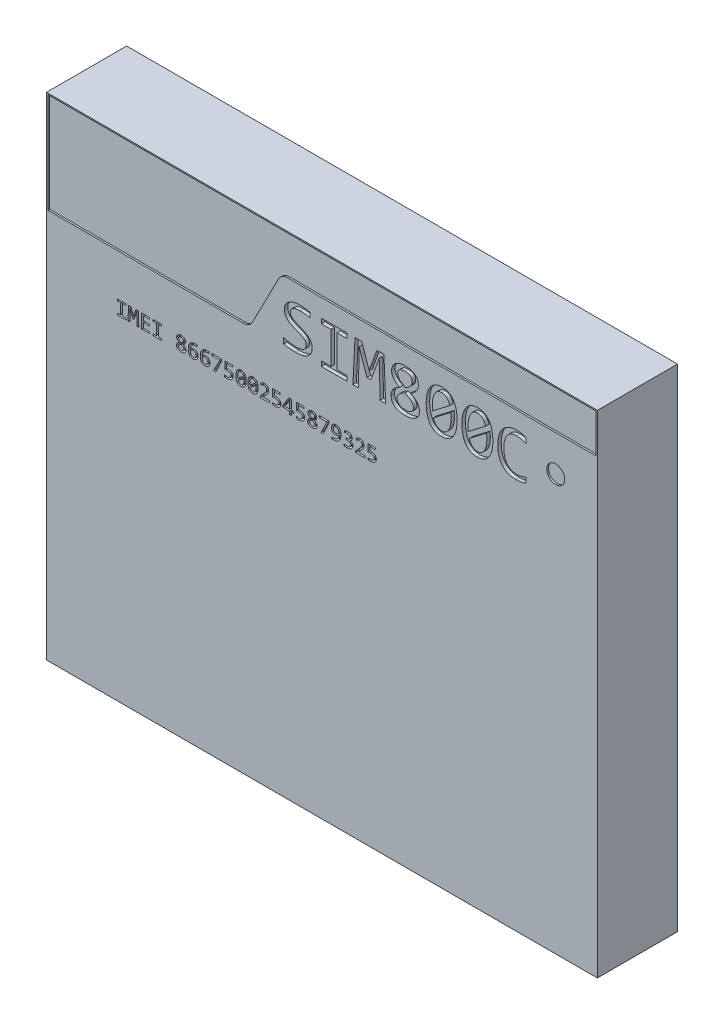
from build123d import *

# Parameters (mm, degrees)
SKICA1_W                 = 15.8
SKICA1_H                 = 14.1
P_IDAT_VYSUNUT_M1_DEPTH  = 2.3
ODEBRAT_VYSUNUT_M1_DEPTH = 0.1
ODEBRAT_VYSUNUT_M2_DEPTH = 0.1
SKICA4_R                 = 0.258036618
ODEBRAT_VYSUNUT_M3_DEPTH = 0.05


with BuildPart() as part:
    # Skica1 → Přidat vysunutím1 (new body)
    with BuildSketch(Plane.XY):
        Rectangle(SKICA1_W, SKICA1_H)
    extrude(amount=P_IDAT_VYSUNUT_M1_DEPTH)

    # Skica2 → Odebrat vysunutím1 (cut)
    # profile 1 of 7: a face of its own
    with BuildSketch(Plane.XY.offset(2.3)):
        with BuildLine():
            add(Edge.make_bspline(
                [(-0.278580103, 4.50737913), (-0.278970629, 4.493493915), (-0.279728242, 4.466556833), (-0.286393921, 4.427360265), (-0.297510169, 4.390952595), (-0.312785666, 4.357084604), (-0.332436511, 4.326371387), (-0.354882223, 4.297704675), (-0.381684283, 4.272489312), (-0.411376486, 4.249529546), (-0.444422608, 4.22932336), (-0.48090721, 4.212318008), (-0.520330134, 4.197626919), (-0.562800909, 4.185781456), (-0.607939784, 4.176573209), (-0.655523953, 4.170247448), (-0.705314344, 4.165977999), (-0.739259236, 4.165502197), (-0.756569234, 4.165259564)],
                knots=[0, 0, 0, 0, 1.005643061, 1.95093061, 2.870738502, 3.757832008, 4.633806625, 5.507195241, 6.389247641, 7.292512577, 8.223494331, 9.189475669, 10.205094408, 11.269007441, 12.381228937, 13.540657028, 14.745872513, 16, 16, 16, 16], degree=3))
            add(Edge.make_bspline(
                [(-0.756569234, 4.165259564), (-0.772513435, 4.165438211), (-0.804325496, 4.165794649), (-0.85163264, 4.167979771), (-0.897914282, 4.171589515), (-0.942478836, 4.175930208), (-0.984988559, 4.180755453), (-1.02488029, 4.186335955), (-1.061650842, 4.192824767), (-1.084932077, 4.197720669), (-1.095971408, 4.200042173)],
                knots=[0, 0, 0, 0, 1.119729043, 2.234096861, 3.324996266, 4.379512959, 5.378439906, 6.329323539, 7.207810484, 8, 8, 8, 8], degree=3))
            Line((-1.095971408, 4.200042173), (-1.095971408, 4.356563912))
            add(Edge.make_bspline(
                [(-1.095971408, 4.356563912), (-1.084152392, 4.352514358), (-1.060003167, 4.3442401), (-1.022122856, 4.334535146), (-0.982387652, 4.325420695), (-0.940419976, 4.317806137), (-0.895810961, 4.311813108), (-0.84839041, 4.307598284), (-0.797999022, 4.304744038), (-0.76345749, 4.30451021), (-0.745699669, 4.304389999)],
                knots=[0, 0, 0, 0, 0.842364813, 1.72116351, 2.635659137, 3.591954833, 4.596841017, 5.670471508, 6.802388115, 8, 8, 8, 8], degree=3))
            add(Edge.make_bspline(
                [(-0.745699669, 4.304389999), (-0.73301256, 4.304520601), (-0.708609461, 4.304771808), (-0.673445837, 4.307398121), (-0.641155784, 4.310822169), (-0.61180886, 4.316769455), (-0.585110533, 4.32361483), (-0.560978611, 4.332325808), (-0.539451166, 4.342692378), (-0.520152655, 4.35431377), (-0.50361341, 4.367741247), (-0.489112865, 4.382212028), (-0.477476133, 4.398354884), (-0.468023527, 4.415786715), (-0.461035715, 4.434566472), (-0.456183117, 4.454644568), (-0.453130529, 4.475945695), (-0.452709358, 4.490611295), (-0.452493147, 4.498139999)],
                knots=[0, 0, 0, 0, 1.523194236, 2.929797672, 4.233142745, 5.41923506, 6.522104548, 7.540643951, 8.494207191, 9.387815665, 10.238903194, 11.04655015, 11.840679357, 12.619387111, 13.4214478, 14.239285369, 15.096122854, 16, 16, 16, 16], degree=3))
            add(Edge.make_bspline(
                [(-0.452493147, 4.498139999), (-0.452762974, 4.505962713), (-0.453290159, 4.521246651), (-0.458674998, 4.54317375), (-0.467094156, 4.563507675), (-0.479437069, 4.581642498), (-0.493942128, 4.598681705), (-0.510982267, 4.614295037), (-0.529792195, 4.629392803), (-0.55833333, 4.648378916), (-0.598270296, 4.670688358), (-0.651470856, 4.692998151), (-0.707886792, 4.715398532), (-0.765784704, 4.738762242), (-0.823667855, 4.763562913), (-0.880453505, 4.789836574), (-0.933711949, 4.819977918), (-0.973816505, 4.849886209), (-1.001836442, 4.876817654), (-1.020898805, 4.89838143), (-1.03725513, 4.921928894), (-1.052364704, 4.946627243), (-1.064185832, 4.973921595), (-1.072387355, 5.003555467), (-1.077830174, 5.035532575), (-1.078324316, 5.057626978), (-1.078580103, 5.069063912)],
                knots=[0, 0, 0, 0, 0.619815692, 1.2109895, 1.781199776, 2.357496674, 2.943929778, 3.554333405, 4.188738872, 4.856760597, 6.272963823, 7.811824644, 9.431291666, 11.092170587, 12.76691914, 14.429617761, 16.056218893, 17.616396577, 18.384212937, 19.138341755, 19.896401647, 20.65718422, 21.4332038, 22.247956952, 23.09307348, 24, 24, 24, 24], degree=3))
            add(Edge.make_bspline(
                [(-1.078580103, 5.069063912), (-1.078268327, 5.079319135), (-1.077644008, 5.099854778), (-1.072486745, 5.130539878), (-1.064375683, 5.160956865), (-1.052956636, 5.190995107), (-1.03799913, 5.2199594), (-1.019795456, 5.247727302), (-0.997435828, 5.273293498), (-0.971796701, 5.297400362), (-0.942134434, 5.319456474), (-0.908819756, 5.339576624), (-0.87131068, 5.356843551), (-0.830325223, 5.372512838), (-0.785037122, 5.38495099), (-0.735670918, 5.393861982), (-0.682216948, 5.398891285), (-0.64525728, 5.399649747), (-0.626134451, 5.400042173)],
                knots=[0, 0, 0, 0, 0.784067079, 1.570060577, 2.373452904, 3.189297991, 4.022898002, 4.862695015, 5.722463422, 6.614650011, 7.550049647, 8.544652583, 9.586108202, 10.704431291, 11.897970904, 13.172772987, 14.537200697, 16, 16, 16, 16], degree=3))
            add(Edge.make_bspline(
                [(-0.626134451, 5.400042173), (-0.615442003, 5.399972897), (-0.593220429, 5.399828925), (-0.558980868, 5.397367525), (-0.52326855, 5.39426323), (-0.486954764, 5.3898163), (-0.450701642, 5.384739583), (-0.415110392, 5.37875419), (-0.380944325, 5.372365966), (-0.358823694, 5.367573196), (-0.348145321, 5.365259564)],
                knots=[0, 0, 0, 0, 0.91416123, 1.89985515, 2.934260182, 3.979599391, 5.027947684, 6.064525625, 7.065681407, 8, 8, 8, 8], degree=3))
            Line((-0.348145321, 5.365259564), (-0.348145321, 5.22612913))
            add(Edge.make_bspline(
                [(-0.348145321, 5.22612913), (-0.371913514, 5.231400757), (-0.419214158, 5.241891727), (-0.490401682, 5.252356982), (-0.560311924, 5.259686), (-0.606460609, 5.260508044), (-0.629123582, 5.260911738)],
                knots=[0, 0, 0, 0, 1.029411825, 2.048613503, 3.041701399, 4, 4, 4, 4], degree=3))
            add(Edge.make_bspline(
                [(-0.629123582, 5.260911738), (-0.640539469, 5.260737243), (-0.662667933, 5.260399003), (-0.694703866, 5.258319398), (-0.724366715, 5.254511252), (-0.751686615, 5.249360749), (-0.776739068, 5.242986924), (-0.799446971, 5.234889258), (-0.819685221, 5.225004988), (-0.837794334, 5.213899387), (-0.853508434, 5.201327268), (-0.867322419, 5.187980338), (-0.878855594, 5.173467006), (-0.888165314, 5.157789858), (-0.895450912, 5.14115733), (-0.901109073, 5.123638975), (-0.903980805, 5.104937419), (-0.904434844, 5.092169879), (-0.90466706, 5.085639999)],
                knots=[0, 0, 0, 0, 1.491437277, 2.890989782, 4.191431573, 5.395946596, 6.521058188, 7.565423013, 8.539223212, 9.458660202, 10.334655275, 11.163081303, 11.963306063, 12.748694206, 13.538083787, 14.331542868, 15.146677777, 16, 16, 16, 16], degree=3))
            add(Edge.make_bspline(
                [(-0.90466706, 5.085639999), (-0.904397536, 5.07781805), (-0.903870944, 5.062535606), (-0.898461823, 5.040516235), (-0.889997653, 5.020125133), (-0.878163598, 5.001424272), (-0.863088722, 4.984757052), (-0.846496767, 4.968544297), (-0.827620229, 4.953334322), (-0.799135035, 4.933859716), (-0.758845705, 4.911666504), (-0.705905905, 4.888381712), (-0.649177107, 4.866619653), (-0.591415885, 4.843026821), (-0.53332491, 4.818484157), (-0.485980726, 4.795652469), (-0.449236855, 4.776053327), (-0.423487128, 4.759623312), (-0.399037679, 4.742294994), (-0.376556386, 4.723150948), (-0.355459224, 4.70290311), (-0.336600055, 4.680647023), (-0.319776948, 4.656867345), (-0.30527115, 4.631324859), (-0.29286387, 4.603967662), (-0.284773015, 4.573869594), (-0.279327881, 4.54145383), (-0.27883508, 4.518997915), (-0.278580103, 4.50737913)],
                knots=[0, 0, 0, 0, 0.667485538, 1.304126353, 1.925325377, 2.548259058, 3.18485279, 3.841928735, 4.529978862, 5.253739616, 6.789399884, 8.452896455, 10.194043647, 11.982660287, 13.786213269, 15.583473082, 16.473910229, 17.343881083, 18.192645259, 19.033319022, 19.865571682, 20.689426309, 21.522902605, 22.351690537, 23.197589349, 24.082454772, 25.007853999, 26, 26, 26, 26], degree=3))
        make_face()
    # profile 2 of 7: a face of its own
    with BuildSketch(Plane.XY.offset(2.3)):
        Polygon((0.260550331, 5.243520434), (-0.017710538, 5.243520434), (-0.017710538, 5.382650869), (0.712724244, 5.382650869), (0.712724244, 5.243520434), (0.434463375, 5.243520434), (0.434463375, 4.321781303), (0.712724244, 4.321781303), (0.712724244, 4.182650869), (-0.017710538, 4.182650869), (-0.017710538, 4.321781303), (0.260550331, 4.321781303), align=None)
    # profile 3 of 7: a face of its own
    with BuildSketch(Plane.XY.offset(2.3)):
        Polygon((1.828756853, 4.182650869), (1.669245984, 4.182650869), (1.651039462, 4.943520434), (1.643159027, 5.21661826), (1.586365549, 5.05411826), (1.406745984, 4.565259564), (1.293702505, 4.565259564), (1.125224244, 5.035639999), (1.069245984, 5.21661826), (1.065441636, 4.930476956), (1.043159027, 4.182650869), (0.88908294, 4.182650869), (0.948865549, 5.382650869), (1.142615549, 5.382650869), (1.304028592, 4.917976956), (1.356202505, 4.761183477), (1.407561201, 4.917976956), (1.57984381, 5.382650869), (1.778756853, 5.382650869), align=None)
    # profile 4 of 7: a face of its own
    with BuildSketch(Plane.XY.offset(2.3)):
        with BuildLine():
            add(Edge.make_bspline(
                [(2.799680766, 4.476672608), (2.799360248, 4.464507905), (2.798734206, 4.440747511), (2.79253574, 4.406257582), (2.782742001, 4.373847949), (2.769152629, 4.343596929), (2.751827645, 4.31566263), (2.731280793, 4.290057717), (2.707842278, 4.266426474), (2.680946686, 4.245659147), (2.651692214, 4.226761958), (2.619498455, 4.210936958), (2.585268421, 4.19650445), (2.54830928, 4.185396516), (2.509368485, 4.176397076), (2.468699008, 4.169912004), (2.426385018, 4.166079504), (2.397695921, 4.165535993), (2.383104679, 4.165259564)],
                knots=[0, 0, 0, 0, 1.000052693, 1.953327181, 2.872788888, 3.780118478, 4.673629746, 5.569872142, 6.476313619, 7.405181598, 8.360347939, 9.33693613, 10.352831955, 11.413662562, 12.507440117, 13.639596934, 14.79950176, 16, 16, 16, 16], degree=3))
            add(Edge.make_bspline(
                [(2.383104679, 4.165259564), (2.36715118, 4.16548816), (2.336275891, 4.16593057), (2.291377156, 4.170257101), (2.249322731, 4.176383982), (2.210297889, 4.186046043), (2.174308783, 4.197947898), (2.141339431, 4.212111342), (2.111219499, 4.228111684), (2.084123745, 4.2462694), (2.060448601, 4.26683362), (2.039545035, 4.288942514), (2.021710596, 4.312955851), (2.007357255, 4.338870689), (1.996016495, 4.366296971), (1.988345562, 4.395190111), (1.983156723, 4.425309957), (1.982581673, 4.445853164), (1.982289462, 4.456292173)],
                knots=[0, 0, 0, 0, 1.375053455, 2.661182599, 3.886103685, 5.035847984, 6.122484779, 7.151019323, 8.125850463, 9.059422521, 9.956479377, 10.823913521, 11.678312387, 12.527879149, 13.371936083, 14.230181046, 15.100668371, 16, 16, 16, 16], degree=3))
            add(Edge.make_bspline(
                [(1.982289462, 4.456292173), (1.982387409, 4.465179738), (1.982579901, 4.482646261), (1.985846062, 4.508319911), (1.990338059, 4.533146675), (1.996819042, 4.557086832), (2.005422271, 4.579978232), (2.015280388, 4.602183985), (2.02778988, 4.623040693), (2.041574551, 4.643424379), (2.057912873, 4.66267806), (2.075779221, 4.681733535), (2.095822229, 4.700368077), (2.117931784, 4.718354852), (2.14211502, 4.735872611), (2.168133737, 4.752927446), (2.196260981, 4.769580148), (2.215940679, 4.780014034), (2.226039462, 4.78536826)],
                knots=[0, 0, 0, 0, 0.9817941, 1.929497053, 2.856500519, 3.769882858, 4.666479047, 5.558197062, 6.451263441, 7.351208482, 8.27561226, 9.239003338, 10.238008998, 11.298365388, 12.387964643, 13.537787702, 14.736497464, 16, 16, 16, 16], degree=3))
            add(Edge.make_bspline(
                [(2.226039462, 4.78536826), (2.216483384, 4.790449943), (2.19788762, 4.800338704), (2.171392718, 4.816182505), (2.146878955, 4.832469835), (2.124384516, 4.84925595), (2.103820019, 4.866433756), (2.085376865, 4.884115953), (2.068653413, 4.902079255), (2.049184283, 4.926464423), (2.029535972, 4.959110195), (2.01194245, 5.000929761), (2.001787204, 5.045758396), (2.000390239, 5.076532555), (1.999680766, 5.092161738)],
                knots=[0, 0, 0, 0, 0.965742151, 1.879297357, 2.753639218, 3.591069971, 4.3828202, 5.143208522, 5.869671325, 6.57156934, 7.92459772, 9.2546127, 10.605708044, 12, 12, 12, 12], degree=3))
            add(Edge.make_bspline(
                [(1.999680766, 5.092161738), (2.000040199, 5.101957701), (2.000755855, 5.12146216), (2.00512594, 5.150569151), (2.012877659, 5.178985126), (2.023103517, 5.206982105), (2.036825029, 5.23373195), (2.053062467, 5.25955564), (2.072848723, 5.283480242), (2.095566185, 5.305921678), (2.121272299, 5.326521886), (2.150243956, 5.344820775), (2.182014512, 5.36116457), (2.217078413, 5.374943949), (2.25513724, 5.386613535), (2.296641337, 5.394099558), (2.341128656, 5.399223731), (2.371856732, 5.399763463), (2.387724244, 5.400042173)],
                knots=[0, 0, 0, 0, 0.84787631, 1.688182144, 2.539998808, 3.393220902, 4.262601171, 5.136739024, 6.028000719, 6.942569753, 7.896211159, 8.872552016, 9.903233579, 10.98328609, 12.129012318, 13.341973747, 14.627435608, 16, 16, 16, 16], degree=3))
            add(Edge.make_bspline(
                [(2.387724244, 5.400042173), (2.402769674, 5.399782055), (2.431914341, 5.399278179), (2.474208579, 5.395383808), (2.513769178, 5.389336959), (2.550440998, 5.380317844), (2.584347946, 5.369182429), (2.615568962, 5.355944179), (2.643817132, 5.340149348), (2.66937316, 5.322387545), (2.692038006, 5.302635125), (2.711429406, 5.28056063), (2.728347533, 5.256902297), (2.741427336, 5.230807975), (2.752306444, 5.20333284), (2.759372985, 5.173956819), (2.764309775, 5.143234927), (2.764699884, 5.122164343), (2.764898157, 5.111455217)],
                knots=[0, 0, 0, 0, 1.344488315, 2.60442309, 3.792969015, 4.918061287, 5.975373753, 6.979920341, 7.943949441, 8.862512087, 9.75736589, 10.623298353, 11.483497483, 12.348862108, 13.225364058, 14.118751848, 15.043855425, 16, 16, 16, 16], degree=3))
            add(Edge.make_bspline(
                [(2.764898157, 5.111455217), (2.764770439, 5.102661043), (2.764519622, 5.085390792), (2.761681161, 5.059956724), (2.757217444, 5.035559678), (2.750435241, 5.012209884), (2.742540662, 4.989713697), (2.732278968, 4.968314059), (2.720344949, 4.947970041), (2.701890209, 4.921813927), (2.674199708, 4.891155685), (2.635460342, 4.857038767), (2.590727622, 4.825019721), (2.557587106, 4.806767626), (2.540441636, 4.797324782)],
                knots=[0, 0, 0, 0, 0.774346025, 1.520682966, 2.251503645, 2.956246805, 3.660447715, 4.349292367, 5.043110025, 5.73600945, 7.165967233, 8.669478215, 10.276932036, 12, 12, 12, 12], degree=3))
            add(Edge.make_bspline(
                [(2.540441636, 4.797324782), (2.558341264, 4.788445743), (2.593477489, 4.77101656), (2.642768494, 4.740741149), (2.687567262, 4.707826562), (2.719866265, 4.676461022), (2.742310142, 4.649808377), (2.757088709, 4.628745388), (2.76990974, 4.606496185), (2.780415683, 4.582943833), (2.789440983, 4.558460647), (2.795163095, 4.532309398), (2.799235114, 4.504971369), (2.799530735, 4.486199534), (2.799680766, 4.476672608)],
                knots=[0, 0, 0, 0, 1.642200187, 3.223570591, 4.7503837, 6.204073382, 6.912600226, 7.613056352, 8.316988316, 9.020289587, 9.731707272, 10.457979509, 11.217406522, 12, 12, 12, 12], degree=3))
        make_face()
        with BuildLine():
            add(Edge.make_bspline(
                [(2.590985114, 5.106020434), (2.590874019, 5.112374709), (2.590658646, 5.124693326), (2.587709253, 5.142396217), (2.583808931, 5.158980608), (2.577735189, 5.174323549), (2.56994149, 5.188446847), (2.560187977, 5.201125753), (2.548961987, 5.212610529), (2.531571827, 5.226664836), (2.505347285, 5.240917181), (2.468967148, 5.252683547), (2.427117637, 5.259652246), (2.397444594, 5.260475953), (2.381745984, 5.260911738)],
                knots=[0, 0, 0, 0, 0.772738455, 1.498057474, 2.180163254, 2.84373868, 3.500404073, 4.137895351, 4.785232637, 5.451825786, 6.854070669, 8.388647673, 10.089403371, 12, 12, 12, 12], degree=3))
            add(Edge.make_bspline(
                [(2.381745984, 5.260911738), (2.366226456, 5.260479248), (2.336820103, 5.259659767), (2.295384224, 5.252618056), (2.259171607, 5.241161077), (2.233082836, 5.227132605), (2.215632524, 5.213429119), (2.204321573, 5.202194027), (2.194735184, 5.189700355), (2.187225807, 5.175836388), (2.180625247, 5.161166592), (2.176938141, 5.144914467), (2.173903624, 5.127691062), (2.173699291, 5.115728407), (2.17359381, 5.109553043)],
                knots=[0, 0, 0, 0, 1.91446195, 3.627516704, 5.169007738, 6.585059734, 7.253819462, 7.902078826, 8.548310414, 9.189005685, 9.845218274, 10.525835054, 11.239006242, 12, 12, 12, 12], degree=3))
            add(Edge.make_bspline(
                [(2.17359381, 5.109553043), (2.174199803, 5.096991278), (2.17538749, 5.072371468), (2.185400101, 5.036802738), (2.20299197, 5.00406372), (2.227800034, 4.973638107), (2.259776865, 4.944999505), (2.297907963, 4.916141439), (2.343772855, 4.888061416), (2.377292261, 4.870317793), (2.395061201, 4.860911738)],
                knots=[0, 0, 0, 0, 0.855423649, 1.676545345, 2.494246317, 3.372850179, 4.338686428, 5.414450719, 6.629377019, 8, 8, 8, 8], degree=3))
            add(Edge.make_bspline(
                [(2.395061201, 4.860911738), (2.41070075, 4.869629359), (2.440457221, 4.886215874), (2.480638765, 4.91379006), (2.514618408, 4.941750098), (2.542815512, 4.970412879), (2.564531036, 5.001088527), (2.580098364, 5.033936104), (2.589328629, 5.069288532), (2.590427147, 5.093647742), (2.590985114, 5.106020434)],
                knots=[0, 0, 0, 0, 1.297113997, 2.467944293, 3.526158232, 4.482572832, 5.373167372, 6.236538477, 7.104290941, 8, 8, 8, 8], degree=3))
        make_face(mode=Mode.SUBTRACT)
        with BuildLine():
            add(Edge.make_bspline(
                [(2.625767723, 4.472324782), (2.625263051, 4.483246917), (2.624251105, 4.505147536), (2.616902265, 4.53186133), (2.608278793, 4.552649072), (2.599474242, 4.568274262), (2.588269965, 4.583609656), (2.575075357, 4.598942621), (2.559751358, 4.614340172), (2.541736871, 4.629336806), (2.521536032, 4.644735974), (2.498659148, 4.659819725), (2.473000998, 4.675221837), (2.444455519, 4.690928352), (2.412362261, 4.706321223), (2.38991831, 4.716482178), (2.378213375, 4.721781303)],
                knots=[0, 0, 0, 0, 1.227361749, 2.461055587, 3.091438311, 3.75771563, 4.473384361, 5.225159627, 6.032379059, 6.914620528, 7.86051044, 8.889517349, 9.996022338, 11.227609097, 12.55414695, 14, 14, 14, 14], degree=3))
            add(Edge.make_bspline(
                [(2.378213375, 4.721781303), (2.368220638, 4.716948291), (2.34881639, 4.707563377), (2.321187562, 4.69301605), (2.296072944, 4.678316596), (2.266984094, 4.659329615), (2.235241712, 4.636121848), (2.204578465, 4.605991274), (2.181490728, 4.575119354), (2.166080139, 4.542881739), (2.157722184, 4.508986174), (2.156715305, 4.485956092), (2.156202505, 4.474226956)],
                knots=[0, 0, 0, 0, 0.943368346, 1.831865993, 2.653115838, 3.415419435, 4.784210071, 5.987266204, 7.055884212, 8.044200493, 9.003918514, 10, 10, 10, 10], degree=3))
            add(Edge.make_bspline(
                [(2.156202505, 4.474226956), (2.156366659, 4.467593533), (2.156688466, 4.454589408), (2.16053181, 4.435773564), (2.16569418, 4.417894939), (2.173859321, 4.40151315), (2.183591003, 4.386275312), (2.195168308, 4.372303184), (2.208301815, 4.359491057), (2.228151986, 4.343566128), (2.257835153, 4.327688292), (2.29808477, 4.313849361), (2.343211475, 4.305874997), (2.374740714, 4.304894941), (2.390985114, 4.304389999)],
                knots=[0, 0, 0, 0, 0.734446881, 1.439805529, 2.122996951, 2.79246048, 3.461245307, 4.124955764, 4.799824334, 5.493278862, 6.941275336, 8.504365142, 10.198989568, 12, 12, 12, 12], degree=3))
            add(Edge.make_bspline(
                [(2.390985114, 4.304389999), (2.406775745, 4.304818184), (2.437555373, 4.305652817), (2.48191394, 4.313297773), (2.522039958, 4.325835427), (2.552180884, 4.340461235), (2.572245818, 4.355803468), (2.586170852, 4.36776362), (2.597398037, 4.382022037), (2.607750323, 4.3969447), (2.615944798, 4.413562144), (2.621594692, 4.431813943), (2.62527913, 4.451524221), (2.625601352, 4.465241984), (2.625767723, 4.472324782)],
                knots=[0, 0, 0, 0, 1.750641714, 3.412409478, 4.972656889, 6.406140501, 7.095417535, 7.771309275, 8.435144008, 9.101180268, 9.784204059, 10.480113466, 11.215247397, 12, 12, 12, 12], degree=3))
        make_face(mode=Mode.SUBTRACT)
    # profile 5 of 7: a face of its own
    with BuildSketch(Plane.XY.offset(2.3)):
        with BuildLine():
            add(Edge.make_bspline(
                [(3.877941636, 4.78210739), (3.877693753, 4.759630761), (3.87720821, 4.715604409), (3.871501898, 4.651204046), (3.862977945, 4.589735883), (3.850804236, 4.531431473), (3.835357646, 4.476491522), (3.815526792, 4.425582945), (3.792651859, 4.378483971), (3.765927956, 4.335541519), (3.735711064, 4.297046458), (3.701978199, 4.262916318), (3.664673742, 4.233481033), (3.623787358, 4.208845372), (3.579471591, 4.188937428), (3.531216102, 4.175346451), (3.479437011, 4.166602742), (3.443649343, 4.165716065), (3.425224244, 4.165259564)],
                knots=[0, 0, 0, 0, 1.248871528, 2.446241243, 3.590357027, 4.69618527, 5.754202854, 6.758290001, 7.728669934, 8.660396172, 9.563796911, 10.443071522, 11.321307858, 12.197637495, 13.090115231, 14.012601613, 14.976798049, 16, 16, 16, 16], degree=3))
            add(Edge.make_bspline(
                [(3.425224244, 4.165259564), (3.409258778, 4.165648214), (3.377811989, 4.166413728), (3.331777713, 4.17331877), (3.28800908, 4.184843036), (3.246426614, 4.200445993), (3.207529324, 4.221306313), (3.17152206, 4.247022251), (3.138250449, 4.277468675), (3.108283118, 4.313179926), (3.081322637, 4.353793074), (3.057935118, 4.399751575), (3.037715176, 4.450629678), (3.020452704, 4.506637508), (3.007424038, 4.568050193), (2.99763638, 4.634651311), (2.992003946, 4.706647842), (2.991332574, 4.75637287), (2.990985114, 4.78210739)],
                knots=[0, 0, 0, 0, 0.897102697, 1.767001224, 2.609309556, 3.43771295, 4.257811968, 5.082953918, 5.919052252, 6.786174452, 7.6970727, 8.653553743, 9.679470751, 10.771494031, 11.944028827, 13.204944144, 14.553456404, 16, 16, 16, 16], degree=3))
            add(Edge.make_bspline(
                [(2.990985114, 4.78210739), (2.991390148, 4.804579612), (2.992184965, 4.848677916), (2.997239639, 4.913320397), (3.006246844, 4.974937487), (3.018613163, 5.03335299), (3.034561905, 5.088358597), (3.05404347, 5.139471449), (3.076897321, 5.186585894), (3.103325053, 5.229586098), (3.133407611, 5.268231477), (3.167233281, 5.302370188), (3.204562978, 5.331903308), (3.245697599, 5.356451626), (3.290200136, 5.376316507), (3.338438649, 5.389927303), (3.389941291, 5.398688196), (3.425458468, 5.399582696), (3.443702505, 5.400042173)],
                knots=[0, 0, 0, 0, 1.248165713, 2.449334701, 3.598380242, 4.704508407, 5.763215836, 6.776019403, 7.739017366, 8.667464557, 9.574217704, 10.452902578, 11.330549874, 12.210601904, 13.107080692, 14.028948355, 14.987533857, 16, 16, 16, 16], degree=3))
            add(Edge.make_bspline(
                [(3.443702505, 5.400042173), (3.459668347, 5.399653524), (3.491115876, 5.398888011), (3.537057927, 5.391995992), (3.580795694, 5.380499584), (3.622211877, 5.364434624), (3.66132155, 5.343903607), (3.697233008, 5.317901215), (3.730415904, 5.287285504), (3.760303948, 5.251336913), (3.787363269, 5.210576633), (3.810965577, 5.164715633), (3.830992635, 5.113650302), (3.848044676, 5.057702675), (3.861644684, 4.996396855), (3.871251302, 4.929826695), (3.876940953, 4.857750693), (3.877599985, 4.80793337), (3.877941636, 4.78210739)],
                knots=[0, 0, 0, 0, 0.896490568, 1.765795528, 2.602608418, 3.432274242, 4.256303472, 5.076742829, 5.915718828, 6.786140009, 7.696416714, 8.659101079, 9.677705081, 10.773848187, 11.941709476, 13.20176442, 14.549356535, 16, 16, 16, 16], degree=3))
        make_face()
        with BuildLine():
            add(Edge.make_bspline(
                [(3.704028592, 4.77286826), (3.703967159, 4.783289611), (3.703844721, 4.804059585), (3.701530017, 4.83501034), (3.699595183, 4.865560327), (3.697651291, 4.885734711), (3.696691636, 4.895694347)],
                knots=[0, 0, 0, 0, 1.015676625, 2.024265076, 3.024624451, 4, 4, 4, 4], degree=3))
            Line((3.696691636, 4.895694347), (3.198865549, 4.513085651))
            add(Edge.make_bspline(
                [(3.198865549, 4.513085651), (3.203765937, 4.49840489), (3.213377598, 4.469609924), (3.231925689, 4.429015714), (3.254660471, 4.392759398), (3.281990812, 4.361892399), (3.313767551, 4.337104139), (3.343358476, 4.321286913), (3.369170741, 4.312737121), (3.389858801, 4.307696968), (3.411936799, 4.305143468), (3.427030676, 4.304644626), (3.434735114, 4.304389999)],
                knots=[0, 0, 0, 0, 1.361870802, 2.671184605, 3.91877896, 5.116024374, 6.280451232, 7.450298556, 8.047911377, 8.670688444, 9.321473259, 10, 10, 10, 10], degree=3))
            add(Edge.make_bspline(
                [(3.434735114, 4.304389999), (3.444729756, 4.304735083), (3.464434034, 4.305415411), (3.493180813, 4.311433713), (3.520616732, 4.320539982), (3.546415702, 4.333894959), (3.570758706, 4.350652521), (3.592714235, 4.371750413), (3.613387288, 4.395774749), (3.631760791, 4.42372969), (3.64832141, 4.455151546), (3.663055423, 4.490121433), (3.675385252, 4.528717919), (3.685642903, 4.570874281), (3.694084498, 4.616394893), (3.699940243, 4.665495312), (3.703516879, 4.718013467), (3.703854471, 4.754202797), (3.704028592, 4.77286826)],
                knots=[0, 0, 0, 0, 0.796240393, 1.569775284, 2.332781704, 3.095240773, 3.878796528, 4.681173991, 5.516437293, 6.40201063, 7.34239963, 8.345981007, 9.424260963, 10.57011489, 11.804224653, 13.114209461, 14.5115885, 16, 16, 16, 16], degree=3))
        make_face(mode=Mode.SUBTRACT)
        with BuildLine():
            add(Edge.make_bspline(
                [(3.164898157, 4.784009564), (3.164886856, 4.774317484), (3.164864254, 4.754932901), (3.165032761, 4.726031413), (3.165991448, 4.697558263), (3.167624914, 4.67884123), (3.168430766, 4.66960739)],
                knots=[0, 0, 0, 0, 1.015676347, 2.03139705, 3.028811753, 4, 4, 4, 4], degree=3))
            Line((3.168430766, 4.66960739), (3.666528592, 5.052216086))
            add(Edge.make_bspline(
                [(3.666528592, 5.052216086), (3.661817799, 5.067120653), (3.652656842, 5.096105173), (3.63325534, 5.136176244), (3.611096563, 5.172340088), (3.583768077, 5.202713134), (3.552839486, 5.228116051), (3.523283401, 5.24352106), (3.497998839, 5.252601603), (3.477708099, 5.257588227), (3.456268179, 5.260151636), (3.441624943, 5.260655807), (3.434191636, 5.260911738)],
                knots=[0, 0, 0, 0, 1.387569518, 2.698370158, 3.946895934, 5.144331536, 6.312393877, 7.486406228, 8.084826247, 8.697958228, 9.339048001, 10, 10, 10, 10], degree=3))
            add(Edge.make_bspline(
                [(3.434191636, 5.260911738), (3.424200526, 5.260556332), (3.404503211, 5.259855654), (3.37576062, 5.253997191), (3.348448483, 5.244326244), (3.322543813, 5.230948781), (3.298156704, 5.213813161), (3.276143612, 5.192348072), (3.25516303, 5.167926998), (3.236932077, 5.139077396), (3.22034049, 5.107001212), (3.205870202, 5.071231091), (3.193628987, 5.0319167), (3.182874844, 4.989146227), (3.174944234, 4.942798351), (3.16895614, 4.893017091), (3.165419672, 4.839677003), (3.165075562, 4.80294608), (3.164898157, 4.784009564)],
                knots=[0, 0, 0, 0, 0.786453526, 1.550480632, 2.299704824, 3.062398082, 3.840423392, 4.637837687, 5.478332318, 6.370910143, 7.318703432, 8.320397478, 9.40580758, 10.560070273, 11.791787257, 13.106920475, 14.508481623, 16, 16, 16, 16], degree=3))
        make_face(mode=Mode.SUBTRACT)
    # profile 6 of 7: a face of its own
    with BuildSketch(Plane.XY.offset(2.3)):
        with BuildLine():
            add(Edge.make_bspline(
                [(4.904028592, 4.78210739), (4.90378071, 4.759630761), (4.903295167, 4.715604409), (4.897588855, 4.651204046), (4.889064901, 4.589735883), (4.876891193, 4.531431473), (4.861444603, 4.476491522), (4.841613749, 4.425582945), (4.818738815, 4.378483971), (4.792014912, 4.335541519), (4.761798021, 4.297046458), (4.728065156, 4.262916318), (4.690760698, 4.233481033), (4.649874315, 4.208845372), (4.605558548, 4.188937428), (4.557303059, 4.175346451), (4.505523967, 4.166602742), (4.4697363, 4.165716065), (4.451311201, 4.165259564)],
                knots=[0, 0, 0, 0, 1.248871528, 2.446241243, 3.590357027, 4.69618527, 5.754202854, 6.758290001, 7.728669934, 8.660396172, 9.563796911, 10.443071522, 11.321307858, 12.197637495, 13.090115231, 14.012601613, 14.976798049, 16, 16, 16, 16], degree=3))
            add(Edge.make_bspline(
                [(4.451311201, 4.165259564), (4.435345734, 4.165648214), (4.403898946, 4.166413728), (4.35786467, 4.17331877), (4.314096037, 4.184843036), (4.27251357, 4.200445993), (4.23361628, 4.221306313), (4.197609016, 4.247022251), (4.164337406, 4.277468675), (4.134370075, 4.313179926), (4.107409593, 4.353793074), (4.084022075, 4.399751575), (4.063802132, 4.450629678), (4.04653966, 4.506637508), (4.033510994, 4.568050193), (4.023723337, 4.634651311), (4.018090902, 4.706647842), (4.01741953, 4.75637287), (4.017072071, 4.78210739)],
                knots=[0, 0, 0, 0, 0.897102697, 1.767001224, 2.609309556, 3.43771295, 4.257811968, 5.082953918, 5.919052252, 6.786174452, 7.6970727, 8.653553743, 9.679470751, 10.771494031, 11.944028827, 13.204944144, 14.553456404, 16, 16, 16, 16], degree=3))
            add(Edge.make_bspline(
                [(4.017072071, 4.78210739), (4.017477104, 4.804579612), (4.018271921, 4.848677916), (4.023326596, 4.913320397), (4.032333801, 4.974937487), (4.04470012, 5.03335299), (4.060648861, 5.088358597), (4.080130426, 5.139471449), (4.102984277, 5.186585894), (4.12941201, 5.229586098), (4.159494568, 5.268231477), (4.193320238, 5.302370188), (4.230649935, 5.331903308), (4.271784555, 5.356451626), (4.316287092, 5.376316507), (4.364525606, 5.389927303), (4.416028248, 5.398688196), (4.451545425, 5.399582696), (4.469789462, 5.400042173)],
                knots=[0, 0, 0, 0, 1.248165713, 2.449334701, 3.598380242, 4.704508407, 5.763215836, 6.776019403, 7.739017366, 8.667464557, 9.574217704, 10.452902578, 11.330549874, 12.210601904, 13.107080692, 14.028948355, 14.987533857, 16, 16, 16, 16], degree=3))
            add(Edge.make_bspline(
                [(4.469789462, 5.400042173), (4.485755304, 5.399653524), (4.517202832, 5.398888011), (4.563144883, 5.391995992), (4.606882651, 5.380499584), (4.648298834, 5.364434624), (4.687408506, 5.343903607), (4.723319964, 5.317901215), (4.756502861, 5.287285504), (4.786390905, 5.251336913), (4.813450225, 5.210576633), (4.837052533, 5.164715633), (4.857079591, 5.113650302), (4.874131632, 5.057702675), (4.887731641, 4.996396855), (4.897338259, 4.929826695), (4.903027909, 4.857750693), (4.903686941, 4.80793337), (4.904028592, 4.78210739)],
                knots=[0, 0, 0, 0, 0.896490568, 1.765795528, 2.602608418, 3.432274242, 4.256303472, 5.076742829, 5.915718828, 6.786140009, 7.696416714, 8.659101079, 9.677705081, 10.773848187, 11.941709476, 13.20176442, 14.549356535, 16, 16, 16, 16], degree=3))
        make_face()
        with BuildLine():
            add(Edge.make_bspline(
                [(4.730115549, 4.77286826), (4.730054116, 4.783289611), (4.729931678, 4.804059585), (4.727616973, 4.83501034), (4.725682139, 4.865560327), (4.723738247, 4.885734711), (4.722778592, 4.895694347)],
                knots=[0, 0, 0, 0, 1.015676625, 2.024265076, 3.024624451, 4, 4, 4, 4], degree=3))
            Line((4.722778592, 4.895694347), (4.224952505, 4.513085651))
            add(Edge.make_bspline(
                [(4.224952505, 4.513085651), (4.229852893, 4.49840489), (4.239464555, 4.469609924), (4.258012646, 4.429015714), (4.280747428, 4.392759398), (4.308077768, 4.361892399), (4.339854508, 4.337104139), (4.369445433, 4.321286913), (4.395257697, 4.312737121), (4.415945757, 4.307696968), (4.438023756, 4.305143468), (4.453117632, 4.304644626), (4.460822071, 4.304389999)],
                knots=[0, 0, 0, 0, 1.361870802, 2.671184605, 3.91877896, 5.116024374, 6.280451232, 7.450298556, 8.047911377, 8.670688444, 9.321473259, 10, 10, 10, 10], degree=3))
            add(Edge.make_bspline(
                [(4.460822071, 4.304389999), (4.470816713, 4.304735083), (4.490520991, 4.305415411), (4.519267769, 4.311433713), (4.546703689, 4.320539982), (4.572502658, 4.333894959), (4.596845662, 4.350652521), (4.618801192, 4.371750413), (4.639474245, 4.395774749), (4.657847748, 4.42372969), (4.674408367, 4.455151546), (4.689142379, 4.490121433), (4.701472209, 4.528717919), (4.711729859, 4.570874281), (4.720171455, 4.616394893), (4.726027199, 4.665495312), (4.729603836, 4.718013467), (4.729941428, 4.754202797), (4.730115549, 4.77286826)],
                knots=[0, 0, 0, 0, 0.796240393, 1.569775284, 2.332781704, 3.095240773, 3.878796528, 4.681173991, 5.516437293, 6.40201063, 7.34239963, 8.345981007, 9.424260963, 10.57011489, 11.804224653, 13.114209461, 14.5115885, 16, 16, 16, 16], degree=3))
        make_face(mode=Mode.SUBTRACT)
        with BuildLine():
            add(Edge.make_bspline(
                [(4.190985114, 4.784009564), (4.190973813, 4.774317484), (4.19095121, 4.754932901), (4.191119717, 4.726031413), (4.192078404, 4.697558263), (4.19371187, 4.67884123), (4.194517723, 4.66960739)],
                knots=[0, 0, 0, 0, 1.015676347, 2.03139705, 3.028811753, 4, 4, 4, 4], degree=3))
            Line((4.194517723, 4.66960739), (4.692615549, 5.052216086))
            add(Edge.make_bspline(
                [(4.692615549, 5.052216086), (4.687904755, 5.067120653), (4.678743799, 5.096105173), (4.659342296, 5.136176244), (4.637183519, 5.172340088), (4.609855034, 5.202713134), (4.578926443, 5.228116051), (4.549370357, 5.24352106), (4.524085796, 5.252601603), (4.503795055, 5.257588227), (4.482355136, 5.260151636), (4.467711899, 5.260655807), (4.460278592, 5.260911738)],
                knots=[0, 0, 0, 0, 1.387569518, 2.698370158, 3.946895934, 5.144331536, 6.312393877, 7.486406228, 8.084826247, 8.697958228, 9.339048001, 10, 10, 10, 10], degree=3))
            add(Edge.make_bspline(
                [(4.460278592, 5.260911738), (4.450287482, 5.260556332), (4.430590167, 5.259855654), (4.401847576, 5.253997191), (4.37453544, 5.244326244), (4.348630769, 5.230948781), (4.32424366, 5.213813161), (4.302230568, 5.192348072), (4.281249987, 5.167926998), (4.263019033, 5.139077396), (4.246427447, 5.107001212), (4.231957159, 5.071231091), (4.219715944, 5.0319167), (4.208961801, 4.989146227), (4.201031191, 4.942798351), (4.195043097, 4.893017091), (4.191506628, 4.839677003), (4.191162519, 4.80294608), (4.190985114, 4.784009564)],
                knots=[0, 0, 0, 0, 0.786453526, 1.550480632, 2.299704824, 3.062398082, 3.840423392, 4.637837687, 5.478332318, 6.370910143, 7.318703432, 8.320397478, 9.40580758, 10.560070273, 11.791787257, 13.106920475, 14.508481623, 16, 16, 16, 16], degree=3))
        make_face(mode=Mode.SUBTRACT)
    # profile 7 of 7: a face of its own
    with BuildSketch(Plane.XY.offset(2.3)):
        with BuildLine():
            add(Edge.make_bspline(
                [(5.860550331, 4.217433477), (5.836677149, 4.209368934), (5.789051721, 4.1932807), (5.715008743, 4.177253922), (5.639459086, 4.167104348), (5.588391117, 4.165876622), (5.562724244, 4.165259564)],
                knots=[0, 0, 0, 0, 0.994474773, 1.983911717, 2.986709619, 4, 4, 4, 4], degree=3))
            add(Edge.make_bspline(
                [(5.562724244, 4.165259564), (5.542414505, 4.165731552), (5.502844561, 4.166651136), (5.445318678, 4.173710734), (5.391454641, 4.185683671), (5.341093998, 4.202203674), (5.294322354, 4.223678126), (5.251377417, 4.250309898), (5.211986917, 4.281402001), (5.176387588, 4.317329893), (5.144725721, 4.357958905), (5.117623266, 4.403456781), (5.09424609, 4.453263654), (5.075890899, 4.507895143), (5.06066184, 4.566764814), (5.050766328, 4.630297015), (5.044336922, 4.698278779), (5.043560199, 4.745134825), (5.043159027, 4.769335651)],
                knots=[0, 0, 0, 0, 1.072370344, 2.089324368, 3.054894172, 3.982167072, 4.883220536, 5.766007853, 6.644560033, 7.52738623, 8.430658994, 9.357672753, 10.318538922, 11.330575956, 12.396783324, 13.526066154, 14.722230158, 16, 16, 16, 16], degree=3))
            add(Edge.make_bspline(
                [(5.043159027, 4.769335651), (5.043665283, 4.792900307), (5.044656586, 4.839042412), (5.051324513, 4.906499828), (5.06318735, 4.970398189), (5.078893275, 5.030801735), (5.099701061, 5.087067574), (5.124058966, 5.13933376), (5.152655903, 5.187050749), (5.185088883, 5.23030985), (5.22153179, 5.2688717), (5.261514579, 5.303025506), (5.305382754, 5.332215241), (5.35250657, 5.35679126), (5.403085729, 5.376212662), (5.456717386, 5.389848265), (5.513248622, 5.398672347), (5.551911222, 5.399578547), (5.571691636, 5.400042173)],
                knots=[0, 0, 0, 0, 1.219579151, 2.388065895, 3.50339749, 4.580233523, 5.613961845, 6.603771101, 7.560489467, 8.487754287, 9.396405489, 10.300984393, 11.203313264, 12.1174982, 13.046432371, 14.000390303, 14.976967236, 16, 16, 16, 16], degree=3))
            add(Edge.make_bspline(
                [(5.571691636, 5.400042173), (5.585192871, 5.399899786), (5.611765092, 5.399619551), (5.650820284, 5.396992781), (5.688413158, 5.393453571), (5.736189596, 5.38563387), (5.794217704, 5.372552057), (5.838514168, 5.35606839), (5.860550331, 5.34786826)],
                knots=[0, 0, 0, 0, 0.82263702, 1.61905864, 2.384719601, 3.122514214, 4.568537041, 6, 6, 6, 6], degree=3))
            Line((5.860550331, 5.34786826), (5.860550331, 5.191346521))
            add(Edge.make_bspline(
                [(5.860550331, 5.191346521), (5.849835077, 5.196824694), (5.828601032, 5.2076806), (5.795626287, 5.221595922), (5.76215106, 5.233504145), (5.727838182, 5.243353538), (5.692660398, 5.2513114), (5.656001313, 5.257078655), (5.617764683, 5.260286751), (5.591715542, 5.260701226), (5.578485114, 5.260911738)],
                knots=[0, 0, 0, 0, 0.983614603, 1.949194672, 2.923566415, 3.886871985, 4.866016098, 5.870457402, 6.918399582, 8, 8, 8, 8], degree=3))
            add(Edge.make_bspline(
                [(5.578485114, 5.260911738), (5.564959227, 5.260620845), (5.538478791, 5.260051346), (5.49980739, 5.253371615), (5.462970267, 5.243573046), (5.428286203, 5.229232875), (5.395757058, 5.211394561), (5.365978723, 5.189264179), (5.338379684, 5.164010118), (5.313548096, 5.134951057), (5.291521987, 5.102445689), (5.272216491, 5.066512031), (5.255246807, 5.027312141), (5.241669605, 4.984544583), (5.230351793, 4.938749616), (5.222654394, 4.889750457), (5.218007002, 4.837632762), (5.217389621, 4.801863882), (5.217072071, 4.783466086)],
                knots=[0, 0, 0, 0, 0.961408976, 1.882207611, 2.784411545, 3.668921893, 4.545980223, 5.417431557, 6.302341026, 7.202770486, 8.13058038, 9.09095177, 10.101446619, 11.165409356, 12.279999165, 13.455113719, 14.691032636, 16, 16, 16, 16], degree=3))
            add(Edge.make_bspline(
                [(5.217072071, 4.783466086), (5.217296192, 4.76425484), (5.217730258, 4.727047534), (5.222108261, 4.673039493), (5.229430307, 4.622677283), (5.239283731, 4.575829799), (5.252322964, 4.532618284), (5.268319106, 4.493128001), (5.287092843, 4.457149014), (5.308884568, 4.424974379), (5.333430269, 4.396310634), (5.361174154, 4.371895701), (5.391166074, 4.35049954), (5.424416358, 4.333892582), (5.45992009, 4.320252153), (5.498334765, 4.311319563), (5.539259066, 4.305370667), (5.567502293, 4.30472291), (5.582017723, 4.304389999)],
                knots=[0, 0, 0, 0, 1.34450783, 2.603970389, 3.789343747, 4.904814261, 5.951782154, 6.944310538, 7.883053746, 8.786934864, 9.658944679, 10.516661903, 11.367981323, 12.229999549, 13.110838734, 14.024275634, 14.984588823, 16, 16, 16, 16], degree=3))
            add(Edge.make_bspline(
                [(5.582017723, 4.304389999), (5.594526997, 4.304569857), (5.61932505, 4.304926401), (5.656071152, 4.308658739), (5.692021011, 4.314293909), (5.738828435, 4.324895634), (5.795919373, 4.34307212), (5.839022099, 4.363668219), (5.860550331, 4.373955217)],
                knots=[0, 0, 0, 0, 0.776705674, 1.539720753, 2.291683871, 3.035542813, 4.519362263, 6, 6, 6, 6], degree=3))
            Line((5.860550331, 4.373955217), (5.860550331, 4.217433477))
        make_face()
    extrude(amount=-ODEBRAT_VYSUNUT_M1_DEPTH, mode=Mode.SUBTRACT)

    # Skica3 → Odebrat vysunutím2 (cut)
    # profile 1 of 21: a face of its own
    with BuildSketch(Plane.XY.offset(2.3)):
        Polygon((-5.77274912, 2.889185531), (-5.865502744, 2.889185531), (-5.865502744, 2.935562343), (-5.622024483, 2.935562343), (-5.622024483, 2.889185531), (-5.714778106, 2.889185531), (-5.714778106, 2.581939154), (-5.622024483, 2.581939154), (-5.622024483, 2.535562343), (-5.865502744, 2.535562343), (-5.865502744, 2.581939154), (-5.77274912, 2.581939154), align=None)
    # profile 2 of 21: a face of its own
    with BuildSketch(Plane.XY.offset(2.3)):
        Polygon((-5.250013613, 2.535562343), (-5.303183903, 2.535562343), (-5.309252744, 2.789185531), (-5.311879555, 2.88021814), (-5.330810715, 2.826051473), (-5.390683903, 2.663098575), (-5.428365062, 2.663098575), (-5.484524483, 2.819892053), (-5.503183903, 2.88021814), (-5.504452019, 2.784837705), (-5.511879555, 2.535562343), (-5.563238251, 2.535562343), (-5.543310715, 2.935562343), (-5.478727381, 2.935562343), (-5.424923033, 2.780671038), (-5.407531729, 2.728406546), (-5.390412164, 2.780671038), (-5.332984628, 2.935562343), (-5.26668028, 2.935562343), align=None)
    # profile 3 of 21: a face of its own
    with BuildSketch(Plane.XY.offset(2.3)):
        Polygon((-4.943763613, 2.535562343), (-5.16985057, 2.535562343), (-5.16985057, 2.935562343), (-4.943763613, 2.935562343), (-4.943763613, 2.889185531), (-5.111879555, 2.889185531), (-5.111879555, 2.767446401), (-4.950466512, 2.767446401), (-4.950466512, 2.721069589), (-5.111879555, 2.721069589), (-5.111879555, 2.581939154), (-4.943763613, 2.581939154), align=None)
    # profile 4 of 21: a face of its own
    with BuildSketch(Plane.XY.offset(2.3)):
        Polygon((-4.746662164, 2.889185531), (-4.839415787, 2.889185531), (-4.839415787, 2.935562343), (-4.595937526, 2.935562343), (-4.595937526, 2.889185531), (-4.688691149, 2.889185531), (-4.688691149, 2.581939154), (-4.595937526, 2.581939154), (-4.595937526, 2.535562343), (-4.839415787, 2.535562343), (-4.839415787, 2.581939154), (-4.746662164, 2.581939154), align=None)
    # profile 5 of 21: a face of its own
    with BuildSketch(Plane.XY.offset(2.3)):
        with BuildLine():
            add(Edge.make_bspline(
                [(-3.900285352, 2.633569589), (-3.900392192, 2.629514688), (-3.900600872, 2.621594557), (-3.902667028, 2.610097914), (-3.905931607, 2.599294703), (-3.910461398, 2.58921103), (-3.916236393, 2.579899596), (-3.923085343, 2.571364626), (-3.930898182, 2.563487545), (-3.939863379, 2.556565102), (-3.94961487, 2.550266039), (-3.960346123, 2.544991039), (-3.971756134, 2.540180203), (-3.984075848, 2.536477558), (-3.997056113, 2.533477745), (-4.010612605, 2.531316055), (-4.024717268, 2.530038554), (-4.034280301, 2.529857384), (-4.039144048, 2.529765241)],
                knots=[0, 0, 0, 0, 1.000052693, 1.953327181, 2.872788888, 3.780118478, 4.673629746, 5.569872142, 6.476313619, 7.405181598, 8.360347939, 9.33693613, 10.352831955, 11.413662562, 12.507440117, 13.639596934, 14.79950176, 16, 16, 16, 16], degree=3))
            add(Edge.make_bspline(
                [(-4.039144048, 2.529765241), (-4.044461881, 2.52984144), (-4.054753644, 2.52998891), (-4.069719889, 2.531431087), (-4.083738031, 2.533473381), (-4.096746311, 2.536694068), (-4.10874268, 2.540661352), (-4.119732464, 2.545382501), (-4.129772441, 2.550715948), (-4.138804359, 2.55676852), (-4.146696074, 2.56362326), (-4.153663929, 2.570992891), (-4.159608743, 2.578997337), (-4.164393189, 2.587635616), (-4.168173443, 2.59677771), (-4.17073042, 2.606408757), (-4.172460033, 2.616448705), (-4.172651717, 2.623296441), (-4.17274912, 2.626776111)],
                knots=[0, 0, 0, 0, 1.375053455, 2.661182599, 3.886103685, 5.035847984, 6.122484779, 7.151019323, 8.125850463, 9.059422521, 9.956479377, 10.823913521, 11.678312387, 12.527879149, 13.371936083, 14.230181046, 15.100668371, 16, 16, 16, 16], degree=3))
            add(Edge.make_bspline(
                [(-4.17274912, 2.626776111), (-4.172716471, 2.629738632), (-4.172652307, 2.635560807), (-4.171563587, 2.64411869), (-4.170066255, 2.652394278), (-4.167905927, 2.660374331), (-4.165038184, 2.668004797), (-4.161752145, 2.675406715), (-4.157582314, 2.682358951), (-4.152987424, 2.689153513), (-4.147541317, 2.695571407), (-4.141585867, 2.701923232), (-4.134904865, 2.708134746), (-4.127535013, 2.714130337), (-4.119473934, 2.71996959), (-4.110801029, 2.725654535), (-4.101425281, 2.731205436), (-4.094865381, 2.734683398), (-4.09149912, 2.73646814)],
                knots=[0, 0, 0, 0, 0.9817941, 1.929497053, 2.856500519, 3.769882858, 4.666479047, 5.558197062, 6.451263441, 7.351208482, 8.27561226, 9.239003338, 10.238008998, 11.298365388, 12.387964643, 13.537787702, 14.736497464, 16, 16, 16, 16], degree=3))
            add(Edge.make_bspline(
                [(-4.09149912, 2.73646814), (-4.09468448, 2.738162034), (-4.100883068, 2.741458288), (-4.109714702, 2.746739555), (-4.117885956, 2.752168665), (-4.125384102, 2.757764037), (-4.132238935, 2.763489972), (-4.138386653, 2.769384038), (-4.143961137, 2.775371805), (-4.150450847, 2.783500194), (-4.157000284, 2.794382118), (-4.162864791, 2.808321974), (-4.166249873, 2.823264852), (-4.166715528, 2.833522905), (-4.166952019, 2.838732633)],
                knots=[0, 0, 0, 0, 0.965742151, 1.879297357, 2.753639218, 3.591069971, 4.3828202, 5.143208522, 5.869671325, 6.57156934, 7.92459772, 9.2546127, 10.605708044, 12, 12, 12, 12], degree=3))
            add(Edge.make_bspline(
                [(-4.166952019, 2.838732633), (-4.166832208, 2.841997954), (-4.166593656, 2.84849944), (-4.165136961, 2.85820177), (-4.162553055, 2.867673762), (-4.159144435, 2.877006088), (-4.154570598, 2.885922703), (-4.149158119, 2.8945306), (-4.1425627, 2.902505467), (-4.134990213, 2.909985946), (-4.126421508, 2.916852682), (-4.116764289, 2.922952312), (-4.106174104, 2.928400243), (-4.094486137, 2.93299337), (-4.081799861, 2.936883231), (-4.067965162, 2.939378573), (-4.053136056, 2.94108663), (-4.042893364, 2.941266541), (-4.037604193, 2.941359444)],
                knots=[0, 0, 0, 0, 0.84787631, 1.688182144, 2.539998808, 3.393220902, 4.262601171, 5.136739024, 6.028000719, 6.942569753, 7.896211159, 8.872552016, 9.903233579, 10.98328609, 12.129012318, 13.341973747, 14.627435608, 16, 16, 16, 16], degree=3))
            add(Edge.make_bspline(
                [(-4.037604193, 2.941359444), (-4.03258905, 2.941272738), (-4.022874161, 2.94110478), (-4.008776081, 2.939806656), (-3.995589215, 2.93779104), (-3.983365275, 2.934784668), (-3.972062959, 2.931072863), (-3.961655954, 2.926660113), (-3.952239897, 2.921395169), (-3.943721221, 2.915474568), (-3.936166272, 2.908890428), (-3.929702472, 2.901532263), (-3.924063097, 2.893646152), (-3.919703162, 2.884948045), (-3.916076793, 2.875789667), (-3.913721279, 2.865997659), (-3.912075683, 2.855757029), (-3.911945646, 2.848733501), (-3.911879555, 2.845163792)],
                knots=[0, 0, 0, 0, 1.344488315, 2.60442309, 3.792969015, 4.918061287, 5.975373753, 6.979920341, 7.943949441, 8.862512087, 9.75736589, 10.623298353, 11.483497483, 12.348862108, 13.225364058, 14.118751848, 15.043855425, 16, 16, 16, 16], degree=3))
            add(Edge.make_bspline(
                [(-3.911879555, 2.845163792), (-3.911922128, 2.842232401), (-3.912005734, 2.836475651), (-3.912951887, 2.827997628), (-3.914439793, 2.819865279), (-3.916700527, 2.812082014), (-3.919332054, 2.804583286), (-3.922752618, 2.797450073), (-3.926730625, 2.790668733), (-3.932882205, 2.781950029), (-3.942112372, 2.771730615), (-3.955025494, 2.760358309), (-3.9699364, 2.749685294), (-3.980983239, 2.743601262), (-3.986698396, 2.740453647)],
                knots=[0, 0, 0, 0, 0.774346025, 1.520682966, 2.251503645, 2.956246805, 3.660447715, 4.349292367, 5.043110025, 5.73600945, 7.165967233, 8.669478215, 10.276932036, 12, 12, 12, 12], degree=3))
            add(Edge.make_bspline(
                [(-3.986698396, 2.740453647), (-3.980731853, 2.737493968), (-3.969019778, 2.73168424), (-3.952589443, 2.721592436), (-3.93765652, 2.710620907), (-3.926890186, 2.700165727), (-3.919408894, 2.691281512), (-3.914482705, 2.684260516), (-3.910209028, 2.676844115), (-3.906707047, 2.668993331), (-3.903698613, 2.660832269), (-3.901791243, 2.652115186), (-3.900433903, 2.64300251), (-3.900335363, 2.636745231), (-3.900285352, 2.633569589)],
                knots=[0, 0, 0, 0, 1.642200187, 3.223570591, 4.7503837, 6.204073382, 6.912600226, 7.613056352, 8.316988316, 9.020289587, 9.731707272, 10.457979509, 11.217406522, 12, 12, 12, 12], degree=3))
        make_face()
        with BuildLine():
            add(Edge.make_bspline(
                [(-3.96985057, 2.843352198), (-3.969887601, 2.84547029), (-3.969959392, 2.849576495), (-3.970942523, 2.855477459), (-3.972242631, 2.861005589), (-3.974267211, 2.866119903), (-3.976865111, 2.870827669), (-3.980116282, 2.875053971), (-3.983858279, 2.87888223), (-3.989654999, 2.883566999), (-3.998396513, 2.88831778), (-4.010523225, 2.892239902), (-4.024473062, 2.894562802), (-4.034364076, 2.894837371), (-4.039596946, 2.894982633)],
                knots=[0, 0, 0, 0, 0.772738455, 1.498057474, 2.180163254, 2.84373868, 3.500404073, 4.137895351, 4.785232637, 5.451825786, 6.854070669, 8.388647673, 10.089403371, 12, 12, 12, 12], degree=3))
            add(Edge.make_bspline(
                [(-4.039596946, 2.894982633), (-4.044770122, 2.894838469), (-4.05457224, 2.894565309), (-4.0683842, 2.892218072), (-4.080455072, 2.888399079), (-4.089151329, 2.883722921), (-4.0949681, 2.879155093), (-4.098738417, 2.875410062), (-4.10193388, 2.871245505), (-4.104437005, 2.866624182), (-4.106637192, 2.861734251), (-4.107866227, 2.856316875), (-4.108877733, 2.85057574), (-4.108945844, 2.846588189), (-4.108981004, 2.844529734)],
                knots=[0, 0, 0, 0, 1.91446195, 3.627516704, 5.169007738, 6.585059734, 7.253819462, 7.902078826, 8.548310414, 9.189005685, 9.845218274, 10.525835054, 11.239006242, 12, 12, 12, 12], degree=3))
            add(Edge.make_bspline(
                [(-4.108981004, 2.844529734), (-4.108779007, 2.840342479), (-4.108383111, 2.832135876), (-4.105045574, 2.820279633), (-4.099181618, 2.809366627), (-4.090912263, 2.799224756), (-4.080253319, 2.789678555), (-4.067542953, 2.780059199), (-4.052254656, 2.770699192), (-4.041081521, 2.764784651), (-4.035158541, 2.761649299)],
                knots=[0, 0, 0, 0, 0.855423649, 1.676545345, 2.494246317, 3.372850179, 4.338686428, 5.414450719, 6.629377019, 8, 8, 8, 8], degree=3))
            add(Edge.make_bspline(
                [(-4.035158541, 2.761649299), (-4.029945358, 2.764555173), (-4.020026534, 2.770084011), (-4.006632686, 2.779275407), (-3.995306138, 2.788595419), (-3.985907104, 2.79814968), (-3.978668596, 2.808374895), (-3.973479486, 2.819324088), (-3.970402731, 2.83110823), (-3.970036559, 2.839227967), (-3.96985057, 2.843352198)],
                knots=[0, 0, 0, 0, 1.297113997, 2.467944293, 3.526158232, 4.482572832, 5.373167372, 6.236538477, 7.104290941, 8, 8, 8, 8], degree=3))
        make_face(mode=Mode.SUBTRACT)
        with BuildLine():
            add(Edge.make_bspline(
                [(-3.958256367, 2.632120314), (-3.958424591, 2.635761026), (-3.958761906, 2.643061232), (-3.961211519, 2.65196583), (-3.96408601, 2.658895077), (-3.96702086, 2.664103474), (-3.970755619, 2.669215272), (-3.975153822, 2.67432626), (-3.980261822, 2.679458777), (-3.986266651, 2.684457655), (-3.993000264, 2.689590711), (-4.000625892, 2.694618628), (-4.009178608, 2.699752666), (-4.018693768, 2.704988171), (-4.029391521, 2.710119128), (-4.036872838, 2.713506113), (-4.040774483, 2.715272488)],
                knots=[0, 0, 0, 0, 1.227361749, 2.461055587, 3.091438311, 3.75771563, 4.473384361, 5.225159627, 6.032379059, 6.914620528, 7.86051044, 8.889517349, 9.996022338, 11.227609097, 12.55414695, 14, 14, 14, 14], degree=3))
            add(Edge.make_bspline(
                [(-4.040774483, 2.715272488), (-4.044105395, 2.713661484), (-4.050573478, 2.710533179), (-4.059783087, 2.70568407), (-4.068154627, 2.700784252), (-4.07785091, 2.694455258), (-4.088431704, 2.686719336), (-4.098652786, 2.676675811), (-4.106348698, 2.666385171), (-4.111485561, 2.6556393), (-4.114271546, 2.644340778), (-4.114607173, 2.636664084), (-4.114778106, 2.632754372)],
                knots=[0, 0, 0, 0, 0.943368346, 1.831865993, 2.653115838, 3.415419435, 4.784210071, 5.987266204, 7.055884212, 8.044200493, 9.003918514, 10, 10, 10, 10], degree=3))
            add(Edge.make_bspline(
                [(-4.114778106, 2.632754372), (-4.114723388, 2.630543231), (-4.114616119, 2.626208523), (-4.113335004, 2.619936574), (-4.111614214, 2.613977033), (-4.108892501, 2.608516437), (-4.105648607, 2.603437157), (-4.101789505, 2.598779781), (-4.097411669, 2.594509072), (-4.090794946, 2.589200762), (-4.080900557, 2.58390815), (-4.067484018, 2.579295173), (-4.052441783, 2.576637052), (-4.041932036, 2.576310367), (-4.036517236, 2.576142053)],
                knots=[0, 0, 0, 0, 0.734446881, 1.439805529, 2.122996951, 2.79246048, 3.461245307, 4.124955764, 4.799824334, 5.493278862, 6.941275336, 8.504365142, 10.198989568, 12, 12, 12, 12], degree=3))
            add(Edge.make_bspline(
                [(-4.036517236, 2.576142053), (-4.031253693, 2.576284781), (-4.020993817, 2.576562992), (-4.006207628, 2.579111311), (-3.992832288, 2.583290529), (-3.982785313, 2.588165798), (-3.976097002, 2.593279876), (-3.971455324, 2.597266593), (-3.967712929, 2.602019399), (-3.964262167, 2.60699362), (-3.961530675, 2.612532768), (-3.959647377, 2.618616701), (-3.958419231, 2.625186794), (-3.958311824, 2.629759381), (-3.958256367, 2.632120314)],
                knots=[0, 0, 0, 0, 1.750641714, 3.412409478, 4.972656889, 6.406140501, 7.095417535, 7.771309275, 8.435144008, 9.101180268, 9.784204059, 10.480113466, 11.215247397, 12, 12, 12, 12], degree=3))
        make_face(mode=Mode.SUBTRACT)
    # profile 6 of 21: a face of its own
    with BuildSketch(Plane.XY.offset(2.3)):
        with BuildLine():
            add(Edge.make_bspline(
                [(-3.552459265, 2.663642053), (-3.552572163, 2.659044747), (-3.552794501, 2.649990887), (-3.554833374, 2.636633656), (-3.557793314, 2.623660742), (-3.562341566, 2.611246556), (-3.567797098, 2.599375479), (-3.57444925, 2.588261451), (-3.582214356, 2.577959272), (-3.590995392, 2.568474837), (-3.600717425, 2.559794543), (-3.61146357, 2.552181968), (-3.623160949, 2.545544775), (-3.635716691, 2.53983841), (-3.649143023, 2.535266848), (-3.663342814, 2.532196676), (-3.678210669, 2.530070562), (-3.688381334, 2.529868548), (-3.693582454, 2.529765241)],
                knots=[0, 0, 0, 0, 1.012808932, 1.994609757, 2.972975015, 3.941440875, 4.903296596, 5.849619333, 6.790801589, 7.742283599, 8.694696427, 9.658806519, 10.639614075, 11.655415064, 12.695226034, 13.759400434, 14.854192403, 16, 16, 16, 16], degree=3))
            add(Edge.make_bspline(
                [(-3.693582454, 2.529765241), (-3.698994007, 2.529870635), (-3.709524012, 2.530075715), (-3.724804266, 2.532135298), (-3.739147582, 2.535347585), (-3.752525859, 2.539975959), (-3.764957057, 2.545939967), (-3.776299198, 2.55346398), (-3.786585746, 2.562388358), (-3.79580892, 2.572755541), (-3.804005179, 2.584512399), (-3.811026638, 2.597751828), (-3.817130799, 2.612322611), (-3.822086962, 2.62837392), (-3.825951566, 2.645918459), (-3.828693919, 2.664961187), (-3.830466008, 2.685528863), (-3.830633379, 2.699749246), (-3.830720135, 2.707120314)],
                knots=[0, 0, 0, 0, 1.01390526, 1.972895057, 2.884568607, 3.765231935, 4.620839519, 5.462251428, 6.308844341, 7.166658115, 8.056926892, 8.988826794, 9.970611799, 11.014270175, 12.133424014, 13.334894011, 14.618554971, 16, 16, 16, 16], degree=3))
            add(Edge.make_bspline(
                [(-3.830720135, 2.707120314), (-3.830544075, 2.717183119), (-3.830196917, 2.737025084), (-3.827504351, 2.761550823), (-3.824464331, 2.780600669), (-3.821315114, 2.794359641), (-3.817738884, 2.807752241), (-3.813382572, 2.820698995), (-3.808350248, 2.833185519), (-3.80250452, 2.845139462), (-3.795919746, 2.856548727), (-3.7884745, 2.867391857), (-3.780092267, 2.877553239), (-3.770907969, 2.887104698), (-3.760608672, 2.895739562), (-3.749478798, 2.903747004), (-3.737259613, 2.910928068), (-3.723999523, 2.917239687), (-3.709749181, 2.922781817), (-3.694424956, 2.927396712), (-3.677973369, 2.931143175), (-3.66028614, 2.933709359), (-3.641375776, 2.935252121), (-3.628368118, 2.935456815), (-3.621662164, 2.935562343)],
                knots=[0, 0, 0, 0, 1.867837564, 3.683025348, 4.575164874, 5.448344215, 6.302400058, 7.148024228, 7.982932617, 8.800284449, 9.616635944, 10.426804332, 11.239354919, 12.06000687, 12.8833352, 13.73118636, 14.6032312, 15.510928969, 16.455180552, 17.43944001, 18.479844542, 19.585049888, 20.754999322, 22, 22, 22, 22], degree=3))
            Line((-3.621662164, 2.935562343), (-3.581444773, 2.935562343))
            Line((-3.581444773, 2.935562343), (-3.581444773, 2.889185531))
            Line((-3.581444773, 2.889185531), (-3.624741874, 2.889185531))
            add(Edge.make_bspline(
                [(-3.624741874, 2.889185531), (-3.630573811, 2.889091356), (-3.641869349, 2.888908953), (-3.658178681, 2.887224353), (-3.673357565, 2.88469642), (-3.687301235, 2.880841869), (-3.700149412, 2.87617546), (-3.71184743, 2.870502727), (-3.722512083, 2.86400279), (-3.732031411, 2.856530089), (-3.740583125, 2.84831546), (-3.748000279, 2.839234949), (-3.754427979, 2.829340785), (-3.759736196, 2.818620333), (-3.764087921, 2.807207371), (-3.767371395, 2.795108811), (-3.770114985, 2.78245733), (-3.77102035, 2.773709127), (-3.771481004, 2.769257995)],
                knots=[0, 0, 0, 0, 1.316020563, 2.548923235, 3.697425437, 4.785341311, 5.809590547, 6.778921485, 7.715223745, 8.623216841, 9.50526042, 10.386645473, 11.263804248, 12.162955214, 13.081906609, 14.016222334, 14.990643414, 16, 16, 16, 16], degree=3))
            Line((-3.771481004, 2.769257995), (-3.77274912, 2.761649299))
            add(Edge.make_bspline(
                [(-3.77274912, 2.761649299), (-3.769416029, 2.763347617), (-3.762634764, 2.766802891), (-3.751896641, 2.771379344), (-3.74034939, 2.775192656), (-3.728158547, 2.778661905), (-3.715312945, 2.781484688), (-3.701904541, 2.783442952), (-3.687989296, 2.784660063), (-3.678548787, 2.784777801), (-3.673745497, 2.784837705)],
                knots=[0, 0, 0, 0, 0.873975351, 1.778126535, 2.724085452, 3.713532888, 4.738948549, 5.794572503, 6.877888282, 8, 8, 8, 8], degree=3))
            add(Edge.make_bspline(
                [(-3.673745497, 2.784837705), (-3.668848402, 2.784749596), (-3.65935389, 2.784578769), (-3.64559358, 2.782798181), (-3.632755908, 2.780029243), (-3.620853182, 2.776143937), (-3.609914773, 2.771212363), (-3.599892107, 2.765431614), (-3.590844602, 2.758666566), (-3.582788198, 2.751045413), (-3.575611998, 2.742624389), (-3.569491352, 2.733341463), (-3.564164409, 2.723330048), (-3.559967379, 2.712510498), (-3.556619258, 2.701082558), (-3.55417021, 2.689089405), (-3.552688608, 2.676541859), (-3.552536637, 2.667993962), (-3.552459265, 2.663642053)],
                knots=[0, 0, 0, 0, 1.208685624, 2.343405611, 3.419797389, 4.447794122, 5.428919399, 6.377784689, 7.299336412, 8.211794848, 9.111090145, 10.025100823, 10.952275575, 11.906224264, 12.885336044, 13.889893727, 14.925701893, 16, 16, 16, 16], degree=3))
        make_face()
        with BuildLine():
            add(Edge.make_bspline(
                [(-3.61043028, 2.662826836), (-3.610479824, 2.665878287), (-3.610576644, 2.671841561), (-3.611408433, 2.680557523), (-3.612748508, 2.688825787), (-3.614647863, 2.696610217), (-3.617040536, 2.703939969), (-3.62024793, 2.71061733), (-3.623961253, 2.716813459), (-3.628456396, 2.722309732), (-3.633432707, 2.727364058), (-3.63909491, 2.731704285), (-3.645351478, 2.735476611), (-3.652225644, 2.738606857), (-3.659759714, 2.741213203), (-3.668003706, 2.742957431), (-3.676945598, 2.744073052), (-3.683131979, 2.744194891), (-3.686336077, 2.744257995)],
                knots=[0, 0, 0, 0, 1.150520734, 2.248395983, 3.298528891, 4.306519537, 5.267901315, 6.199977448, 7.094361736, 7.985260264, 8.870904429, 9.763692766, 10.667808702, 11.620520663, 12.607126569, 13.668007045, 14.792196064, 16, 16, 16, 16], degree=3))
            add(Edge.make_bspline(
                [(-3.686336077, 2.744257995), (-3.690177236, 2.744159023), (-3.697957744, 2.743958549), (-3.709587094, 2.742127688), (-3.721182968, 2.739427878), (-3.732541702, 2.735779186), (-3.743566942, 2.731473612), (-3.753981784, 2.726468189), (-3.763792906, 2.721230225), (-3.769818732, 2.717221803), (-3.77274912, 2.715272488)],
                knots=[0, 0, 0, 0, 0.996946629, 2.019377751, 3.050253168, 4.086838532, 5.114847083, 6.121490909, 7.086471756, 8, 8, 8, 8], degree=3))
            add(Edge.make_bspline(
                [(-3.77274912, 2.715272488), (-3.772676004, 2.708900616), (-3.772535913, 2.696692034), (-3.771581487, 2.679185994), (-3.769862925, 2.663316723), (-3.767586081, 2.649015783), (-3.764471914, 2.636220848), (-3.760811846, 2.624778085), (-3.756490147, 2.614647475), (-3.751489071, 2.605852957), (-3.74584454, 2.598278091), (-3.739425876, 2.592016201), (-3.73251012, 2.586731662), (-3.724853555, 2.582737108), (-3.716646202, 2.579754768), (-3.707855808, 2.577693641), (-3.698481796, 2.57640127), (-3.692016778, 2.576230102), (-3.688691149, 2.576142053)],
                knots=[0, 0, 0, 0, 1.650077294, 3.161567569, 4.537910215, 5.782191403, 6.908651052, 7.944673017, 8.890238795, 9.755310799, 10.559096379, 11.327615804, 12.070408139, 12.804923978, 13.554434846, 14.326288083, 15.139036615, 16, 16, 16, 16], degree=3))
            add(Edge.make_bspline(
                [(-3.688691149, 2.576142053), (-3.685878695, 2.576204329), (-3.680382846, 2.576326024), (-3.672331421, 2.577496973), (-3.66459541, 2.579142684), (-3.657249272, 2.581700178), (-3.650351469, 2.584990657), (-3.643857492, 2.588858265), (-3.637963028, 2.593554862), (-3.632486653, 2.598796332), (-3.627605296, 2.604766594), (-3.623094717, 2.611237713), (-3.61947574, 2.618505766), (-3.61610623, 2.626187648), (-3.61365344, 2.63457087), (-3.611688807, 2.643485873), (-3.610639284, 2.652988926), (-3.610500886, 2.659503357), (-3.61043028, 2.662826836)],
                knots=[0, 0, 0, 0, 1.025083503, 2.003127546, 2.96226617, 3.906046368, 4.832121212, 5.74620198, 6.656027477, 7.575003842, 8.505585477, 9.464660881, 10.444810511, 11.461340613, 12.520347712, 13.624044888, 14.787854947, 16, 16, 16, 16], degree=3))
        make_face(mode=Mode.SUBTRACT)
    # profile 7 of 21: a face of its own
    with BuildSketch(Plane.XY.offset(2.3)):
        with BuildLine():
            add(Edge.make_bspline(
                [(-3.21043028, 2.663642053), (-3.210543177, 2.659044747), (-3.210765515, 2.649990887), (-3.212804388, 2.636633656), (-3.215764329, 2.623660742), (-3.220312581, 2.611246556), (-3.225768112, 2.599375479), (-3.232420264, 2.588261451), (-3.24018537, 2.577959272), (-3.248966406, 2.568474837), (-3.25868844, 2.559794543), (-3.269434585, 2.552181968), (-3.281131963, 2.545544775), (-3.293687705, 2.53983841), (-3.307114037, 2.535266848), (-3.321313828, 2.532196676), (-3.336181683, 2.530070562), (-3.346352349, 2.529868548), (-3.351553468, 2.529765241)],
                knots=[0, 0, 0, 0, 1.012808932, 1.994609757, 2.972975015, 3.941440875, 4.903296596, 5.849619333, 6.790801589, 7.742283599, 8.694696427, 9.658806519, 10.639614075, 11.655415064, 12.695226034, 13.759400434, 14.854192403, 16, 16, 16, 16], degree=3))
            add(Edge.make_bspline(
                [(-3.351553468, 2.529765241), (-3.356965022, 2.529870635), (-3.367495027, 2.530075715), (-3.382775281, 2.532135298), (-3.397118597, 2.535347585), (-3.410496874, 2.539975959), (-3.422928072, 2.545939967), (-3.434270212, 2.55346398), (-3.444556761, 2.562388358), (-3.453779935, 2.572755541), (-3.461976194, 2.584512399), (-3.468997652, 2.597751828), (-3.475101813, 2.612322611), (-3.480057976, 2.62837392), (-3.483922581, 2.645918459), (-3.486664933, 2.664961187), (-3.488437022, 2.685528863), (-3.488604393, 2.699749246), (-3.488691149, 2.707120314)],
                knots=[0, 0, 0, 0, 1.01390526, 1.972895057, 2.884568607, 3.765231935, 4.620839519, 5.462251428, 6.308844341, 7.166658115, 8.056926892, 8.988826794, 9.970611799, 11.014270175, 12.133424014, 13.334894011, 14.618554971, 16, 16, 16, 16], degree=3))
            add(Edge.make_bspline(
                [(-3.488691149, 2.707120314), (-3.488515089, 2.717183119), (-3.488167932, 2.737025084), (-3.485475366, 2.761550823), (-3.482435346, 2.780600669), (-3.479286129, 2.794359641), (-3.475709899, 2.807752241), (-3.471353586, 2.820698995), (-3.466321263, 2.833185519), (-3.460475534, 2.845139462), (-3.453890761, 2.856548727), (-3.446445514, 2.867391857), (-3.438063282, 2.877553239), (-3.428878984, 2.887104698), (-3.418579687, 2.895739562), (-3.407449813, 2.903747004), (-3.395230628, 2.910928068), (-3.381970538, 2.917239687), (-3.367720195, 2.922781817), (-3.35239597, 2.927396712), (-3.335944384, 2.931143175), (-3.318257154, 2.933709359), (-3.299346791, 2.935252121), (-3.286339132, 2.935456815), (-3.279633178, 2.935562343)],
                knots=[0, 0, 0, 0, 1.867837564, 3.683025348, 4.575164874, 5.448344215, 6.302400058, 7.148024228, 7.982932617, 8.800284449, 9.616635944, 10.426804332, 11.239354919, 12.06000687, 12.8833352, 13.73118636, 14.6032312, 15.510928969, 16.455180552, 17.43944001, 18.479844542, 19.585049888, 20.754999322, 22, 22, 22, 22], degree=3))
            Line((-3.279633178, 2.935562343), (-3.239415787, 2.935562343))
            Line((-3.239415787, 2.935562343), (-3.239415787, 2.889185531))
            Line((-3.239415787, 2.889185531), (-3.282712889, 2.889185531))
            add(Edge.make_bspline(
                [(-3.282712889, 2.889185531), (-3.288544826, 2.889091356), (-3.299840363, 2.888908953), (-3.316149696, 2.887224353), (-3.331328579, 2.88469642), (-3.34527225, 2.880841869), (-3.358120427, 2.87617546), (-3.369818444, 2.870502727), (-3.380483097, 2.86400279), (-3.390002426, 2.856530089), (-3.398554139, 2.84831546), (-3.405971294, 2.839234949), (-3.412398994, 2.829340785), (-3.41770721, 2.818620333), (-3.422058935, 2.807207371), (-3.425342409, 2.795108811), (-3.428085999, 2.78245733), (-3.428991364, 2.773709127), (-3.429452019, 2.769257995)],
                knots=[0, 0, 0, 0, 1.316020563, 2.548923235, 3.697425437, 4.785341311, 5.809590547, 6.778921485, 7.715223745, 8.623216841, 9.50526042, 10.386645473, 11.263804248, 12.162955214, 13.081906609, 14.016222334, 14.990643414, 16, 16, 16, 16], degree=3))
            Line((-3.429452019, 2.769257995), (-3.430720135, 2.761649299))
            add(Edge.make_bspline(
                [(-3.430720135, 2.761649299), (-3.427387043, 2.763347617), (-3.420605778, 2.766802891), (-3.409867656, 2.771379344), (-3.398320405, 2.775192656), (-3.386129562, 2.778661905), (-3.37328396, 2.781484688), (-3.359875556, 2.783442952), (-3.345960311, 2.784660063), (-3.336519801, 2.784777801), (-3.331716512, 2.784837705)],
                knots=[0, 0, 0, 0, 0.873975351, 1.778126535, 2.724085452, 3.713532888, 4.738948549, 5.794572503, 6.877888282, 8, 8, 8, 8], degree=3))
            add(Edge.make_bspline(
                [(-3.331716512, 2.784837705), (-3.326819417, 2.784749596), (-3.317324905, 2.784578769), (-3.303564594, 2.782798181), (-3.290726923, 2.780029243), (-3.278824197, 2.776143937), (-3.267885788, 2.771212363), (-3.257863122, 2.765431614), (-3.248815616, 2.758666566), (-3.240759212, 2.751045413), (-3.233583012, 2.742624389), (-3.227462366, 2.733341463), (-3.222135423, 2.723330048), (-3.217938394, 2.712510498), (-3.214590272, 2.701082558), (-3.212141224, 2.689089405), (-3.210659623, 2.676541859), (-3.210507652, 2.667993962), (-3.21043028, 2.663642053)],
                knots=[0, 0, 0, 0, 1.208685624, 2.343405611, 3.419797389, 4.447794122, 5.428919399, 6.377784689, 7.299336412, 8.211794848, 9.111090145, 10.025100823, 10.952275575, 11.906224264, 12.885336044, 13.889893727, 14.925701893, 16, 16, 16, 16], degree=3))
        make_face()
        with BuildLine():
            add(Edge.make_bspline(
                [(-3.268401294, 2.662826836), (-3.268450838, 2.665878287), (-3.268547658, 2.671841561), (-3.269379448, 2.680557523), (-3.270719522, 2.688825787), (-3.272618878, 2.696610217), (-3.275011551, 2.703939969), (-3.278218944, 2.71061733), (-3.281932268, 2.716813459), (-3.286427411, 2.722309732), (-3.291403721, 2.727364058), (-3.297065924, 2.731704285), (-3.303322493, 2.735476611), (-3.310196658, 2.738606857), (-3.317730728, 2.741213203), (-3.325974721, 2.742957431), (-3.334916613, 2.744073052), (-3.341102993, 2.744194891), (-3.344307091, 2.744257995)],
                knots=[0, 0, 0, 0, 1.150520734, 2.248395983, 3.298528891, 4.306519537, 5.267901315, 6.199977448, 7.094361736, 7.985260264, 8.870904429, 9.763692766, 10.667808702, 11.620520663, 12.607126569, 13.668007045, 14.792196064, 16, 16, 16, 16], degree=3))
            add(Edge.make_bspline(
                [(-3.344307091, 2.744257995), (-3.34814825, 2.744159023), (-3.355928758, 2.743958549), (-3.367558108, 2.742127688), (-3.379153982, 2.739427878), (-3.390512717, 2.735779186), (-3.401537957, 2.731473612), (-3.411952798, 2.726468189), (-3.421763921, 2.721230225), (-3.427789746, 2.717221803), (-3.430720135, 2.715272488)],
                knots=[0, 0, 0, 0, 0.996946629, 2.019377751, 3.050253168, 4.086838532, 5.114847083, 6.121490909, 7.086471756, 8, 8, 8, 8], degree=3))
            add(Edge.make_bspline(
                [(-3.430720135, 2.715272488), (-3.430647019, 2.708900616), (-3.430506927, 2.696692034), (-3.429552502, 2.679185994), (-3.42783394, 2.663316723), (-3.425557096, 2.649015783), (-3.422442928, 2.636220848), (-3.41878286, 2.624778085), (-3.414461161, 2.614647475), (-3.409460085, 2.605852957), (-3.403815554, 2.598278091), (-3.39739689, 2.592016201), (-3.390481135, 2.586731662), (-3.38282457, 2.582737108), (-3.374617217, 2.579754768), (-3.365826822, 2.577693641), (-3.35645281, 2.57640127), (-3.349987792, 2.576230102), (-3.346662164, 2.576142053)],
                knots=[0, 0, 0, 0, 1.650077294, 3.161567569, 4.537910215, 5.782191403, 6.908651052, 7.944673017, 8.890238795, 9.755310799, 10.559096379, 11.327615804, 12.070408139, 12.804923978, 13.554434846, 14.326288083, 15.139036615, 16, 16, 16, 16], degree=3))
            add(Edge.make_bspline(
                [(-3.346662164, 2.576142053), (-3.34384971, 2.576204329), (-3.33835386, 2.576326024), (-3.330302436, 2.577496973), (-3.322566424, 2.579142684), (-3.315220286, 2.581700178), (-3.308322484, 2.584990657), (-3.301828507, 2.588858265), (-3.295934042, 2.593554862), (-3.290457667, 2.598796332), (-3.285576311, 2.604766594), (-3.281065731, 2.611237713), (-3.277446755, 2.618505766), (-3.274077245, 2.626187648), (-3.271624454, 2.63457087), (-3.269659821, 2.643485873), (-3.268610299, 2.652988926), (-3.268471901, 2.659503357), (-3.268401294, 2.662826836)],
                knots=[0, 0, 0, 0, 1.025083503, 2.003127546, 2.96226617, 3.906046368, 4.832121212, 5.74620198, 6.656027477, 7.575003842, 8.505585477, 9.464660881, 10.444810511, 11.461340613, 12.520347712, 13.624044888, 14.787854947, 16, 16, 16, 16], degree=3))
        make_face(mode=Mode.SUBTRACT)
    # profile 8 of 21: a face of its own
    with BuildSketch(Plane.XY.offset(2.3)):
        Polygon((-2.874198396, 2.88338843), (-3.043129555, 2.535562343), (-3.10399912, 2.535562343), (-2.928546222, 2.88338843), (-3.146662164, 2.88338843), (-3.146662164, 2.935562343), (-2.874198396, 2.935562343), align=None)
    # profile 9 of 21: a face of its own
    with BuildSketch(Plane.XY.offset(2.3)):
        with BuildLine():
            add(Edge.make_bspline(
                [(-2.543763613, 2.66463843), (-2.54392495, 2.659738292), (-2.544242569, 2.650091567), (-2.546619295, 2.635925471), (-2.550724234, 2.6224618), (-2.556401487, 2.609732491), (-2.563367953, 2.597750129), (-2.571665276, 2.586655078), (-2.581169036, 2.576456286), (-2.591803918, 2.567091689), (-2.6035557, 2.5586965), (-2.616422969, 2.551316178), (-2.630213427, 2.544800738), (-2.645019496, 2.539399927), (-2.66054508, 2.535044308), (-2.676785739, 2.531965851), (-2.693631105, 2.53014404), (-2.705081602, 2.529892625), (-2.710883178, 2.529765241)],
                knots=[0, 0, 0, 0, 0.98172717, 1.932690758, 2.868675772, 3.79512682, 4.719778069, 5.640699909, 6.565489728, 7.508663867, 8.475813283, 9.454477684, 10.477621026, 11.528583183, 12.609071962, 13.705570848, 14.837491085, 16, 16, 16, 16], degree=3))
            add(Edge.make_bspline(
                [(-2.710883178, 2.529765241), (-2.713963083, 2.52977985), (-2.720336317, 2.529810079), (-2.730094007, 2.530163019), (-2.740137736, 2.530890354), (-2.750239078, 2.531392964), (-2.760186351, 2.532420667), (-2.769804996, 2.533213109), (-2.778802506, 2.53430691), (-2.784526144, 2.535158353), (-2.787241874, 2.535562343)],
                knots=[0, 0, 0, 0, 0.964491421, 1.995817636, 3.056882487, 4.117947338, 5.162324201, 6.187869467, 7.140187366, 8, 8, 8, 8], degree=3))
            Line((-2.787241874, 2.535562343), (-2.787241874, 2.581939154))
            add(Edge.make_bspline(
                [(-2.787241874, 2.581939154), (-2.781393603, 2.580991923), (-2.768959102, 2.578977934), (-2.749315033, 2.577347263), (-2.72840561, 2.576376512), (-2.71414525, 2.576220402), (-2.706988251, 2.576142053)],
                knots=[0, 0, 0, 0, 0.882238515, 1.875801315, 2.933905742, 4, 4, 4, 4], degree=3))
            add(Edge.make_bspline(
                [(-2.706988251, 2.576142053), (-2.703031005, 2.576212426), (-2.695282169, 2.576350227), (-2.683976704, 2.577400125), (-2.673309695, 2.579363175), (-2.663233638, 2.581844186), (-2.653832461, 2.585085076), (-2.645145938, 2.58902497), (-2.637155168, 2.593507029), (-2.629942841, 2.598723738), (-2.623487429, 2.604511218), (-2.617849304, 2.610923851), (-2.612871378, 2.617809004), (-2.608909994, 2.625402335), (-2.605728078, 2.633511632), (-2.603362443, 2.642094048), (-2.601981672, 2.6511879), (-2.6018183, 2.657387298), (-2.601734628, 2.660562343)],
                knots=[0, 0, 0, 0, 1.24924794, 2.446200838, 3.579242984, 4.670415696, 5.719433635, 6.713395331, 7.678134183, 8.606690161, 9.517812713, 10.409125339, 11.297783723, 12.193215167, 13.104786339, 14.043608292, 14.99802676, 16, 16, 16, 16], degree=3))
            add(Edge.make_bspline(
                [(-2.601734628, 2.660562343), (-2.601834583, 2.663614379), (-2.602027357, 2.669500559), (-2.603141954, 2.678069461), (-2.605369325, 2.685911174), (-2.608224335, 2.693212098), (-2.612107571, 2.699733306), (-2.616647839, 2.705777757), (-2.622244068, 2.710979741), (-2.628570066, 2.71564901), (-2.635648157, 2.719727486), (-2.643523062, 2.723127864), (-2.652048451, 2.726130715), (-2.661310869, 2.728586805), (-2.671350597, 2.730334555), (-2.682078483, 2.731697295), (-2.693569701, 2.732520662), (-2.701461525, 2.732615033), (-2.705538975, 2.732663792)],
                knots=[0, 0, 0, 0, 1.018778499, 1.96482378, 2.874050982, 3.732757355, 4.572520443, 5.398697291, 6.246699149, 7.111119102, 8.018334738, 8.965559426, 9.969232179, 11.032231485, 12.15860358, 13.366965149, 14.639596152, 16, 16, 16, 16], degree=3))
            Line((-2.705538975, 2.732663792), (-2.781444773, 2.732663792))
            Line((-2.781444773, 2.732663792), (-2.781444773, 2.935562343))
            Line((-2.781444773, 2.935562343), (-2.566952019, 2.935562343))
            Line((-2.566952019, 2.935562343), (-2.566952019, 2.889185531))
            Line((-2.566952019, 2.889185531), (-2.72927086, 2.889185531))
            Line((-2.72927086, 2.889185531), (-2.72927086, 2.779040604))
            Line((-2.72927086, 2.779040604), (-2.694578831, 2.779040604))
            add(Edge.make_bspline(
                [(-2.694578831, 2.779040604), (-2.689837756, 2.778952819), (-2.680437917, 2.778778774), (-2.666396808, 2.777936915), (-2.652602781, 2.776124707), (-2.639029715, 2.773952843), (-2.625871507, 2.770945617), (-2.61342045, 2.766782908), (-2.601692527, 2.761653836), (-2.590697633, 2.755641012), (-2.580597201, 2.748448704), (-2.571433005, 2.740177761), (-2.563458133, 2.730639666), (-2.55639336, 2.720084111), (-2.550568988, 2.708237204), (-2.546679569, 2.694878399), (-2.5441747, 2.680221788), (-2.543904092, 2.66996364), (-2.543763613, 2.66463843)],
                knots=[0, 0, 0, 0, 1.059175612, 2.099962526, 3.139743828, 4.165320853, 5.169746916, 6.150783593, 7.093036138, 8.02582832, 8.944668115, 9.856526481, 10.775316774, 11.714305364, 12.688572902, 13.710506815, 14.811478169, 16, 16, 16, 16], degree=3))
        make_face()
    # profile 10 of 21: a face of its own
    with BuildSketch(Plane.XY.offset(2.3)):
        with BuildLine():
            add(Edge.make_bspline(
                [(-2.17274912, 2.735381183), (-2.172831748, 2.727888974), (-2.172993596, 2.713213523), (-2.1748957, 2.691746735), (-2.177737017, 2.671257347), (-2.18179492, 2.651822544), (-2.186943784, 2.633509227), (-2.193554068, 2.616539702), (-2.201179046, 2.600840043), (-2.210087014, 2.586525893), (-2.220159311, 2.573694206), (-2.231403599, 2.562317493), (-2.243838418, 2.552505731), (-2.257467213, 2.544293844), (-2.272239135, 2.537657863), (-2.288324298, 2.533127537), (-2.305583995, 2.530212967), (-2.317513218, 2.529917408), (-2.323654918, 2.529765241)],
                knots=[0, 0, 0, 0, 1.248871528, 2.446241243, 3.590357027, 4.69618527, 5.754202854, 6.758290001, 7.728669934, 8.660396172, 9.563796911, 10.443071522, 11.321307858, 12.197637495, 13.090115231, 14.012601613, 14.976798049, 16, 16, 16, 16], degree=3))
            add(Edge.make_bspline(
                [(-2.323654918, 2.529765241), (-2.32897674, 2.529894791), (-2.339459003, 2.530149962), (-2.354803761, 2.532451643), (-2.369393306, 2.536293065), (-2.383254128, 2.541494051), (-2.396219891, 2.548447491), (-2.408222312, 2.55701947), (-2.419312849, 2.567168278), (-2.42930196, 2.579072029), (-2.438288787, 2.592609745), (-2.446084626, 2.607929245), (-2.452824607, 2.624888612), (-2.458578764, 2.643557889), (-2.462921653, 2.664028784), (-2.466184206, 2.686229157), (-2.468061684, 2.710228), (-2.468285474, 2.72680301), (-2.468401294, 2.735381183)],
                knots=[0, 0, 0, 0, 0.897102697, 1.767001224, 2.609309556, 3.43771295, 4.257811968, 5.082953918, 5.919052252, 6.786174452, 7.6970727, 8.653553743, 9.679470751, 10.771494031, 11.944028827, 13.204944144, 14.553456404, 16, 16, 16, 16], degree=3))
            add(Edge.make_bspline(
                [(-2.468401294, 2.735381183), (-2.468266283, 2.742871924), (-2.468001344, 2.757571358), (-2.466316453, 2.779118852), (-2.463314051, 2.799657882), (-2.459191945, 2.819129716), (-2.453875697, 2.837464919), (-2.447381842, 2.854502536), (-2.439763892, 2.870207351), (-2.430954648, 2.884540752), (-2.420927129, 2.897422546), (-2.409651905, 2.908802116), (-2.397208673, 2.918646489), (-2.383497133, 2.926829262), (-2.368662954, 2.933450889), (-2.352583449, 2.937987821), (-2.335415902, 2.940908118), (-2.323576843, 2.941206285), (-2.317495497, 2.941359444)],
                knots=[0, 0, 0, 0, 1.248165713, 2.449334701, 3.598380242, 4.704508407, 5.763215836, 6.776019403, 7.739017366, 8.667464557, 9.574217704, 10.452902578, 11.330549874, 12.210601904, 13.107080692, 14.028948355, 14.987533857, 16, 16, 16, 16], degree=3))
            add(Edge.make_bspline(
                [(-2.317495497, 2.941359444), (-2.31217355, 2.941229895), (-2.30169104, 2.940974724), (-2.286377023, 2.938677384), (-2.271797768, 2.934845248), (-2.257992373, 2.929490261), (-2.244955816, 2.922646589), (-2.23298533, 2.913979125), (-2.221924364, 2.903773888), (-2.211961683, 2.891791024), (-2.202941909, 2.878204264), (-2.195074473, 2.862917264), (-2.188398787, 2.845895487), (-2.182714774, 2.827246278), (-2.178181438, 2.806811005), (-2.174979232, 2.784620952), (-2.173082681, 2.760595618), (-2.172863004, 2.743989843), (-2.17274912, 2.735381183)],
                knots=[0, 0, 0, 0, 0.896490568, 1.765795528, 2.602608418, 3.432274242, 4.256303472, 5.076742829, 5.915718828, 6.786140009, 7.696416714, 8.659101079, 9.677705081, 10.773848187, 11.941709476, 13.20176442, 14.549356535, 16, 16, 16, 16], degree=3))
        make_face()
        with BuildLine():
            add(Edge.make_bspline(
                [(-2.230720135, 2.732301473), (-2.230740613, 2.735775257), (-2.230781425, 2.742698582), (-2.231552993, 2.7530155), (-2.232197938, 2.763198829), (-2.232845902, 2.769923624), (-2.233165787, 2.773243502)],
                knots=[0, 0, 0, 0, 1.015676625, 2.024265076, 3.024624451, 4, 4, 4, 4], degree=3))
            Line((-2.233165787, 2.773243502), (-2.399107816, 2.64570727))
            add(Edge.make_bspline(
                [(-2.399107816, 2.64570727), (-2.397474353, 2.640813683), (-2.394270466, 2.631215361), (-2.388087769, 2.617683958), (-2.380509509, 2.605598519), (-2.371399395, 2.595309519), (-2.360807149, 2.587046766), (-2.350943507, 2.581774357), (-2.342339419, 2.578924427), (-2.335443399, 2.577244376), (-2.328084066, 2.576393209), (-2.323052774, 2.576226928), (-2.320484628, 2.576142053)],
                knots=[0, 0, 0, 0, 1.361870802, 2.671184605, 3.91877896, 5.116024374, 6.280451232, 7.450298556, 8.047911377, 8.670688444, 9.321473259, 10, 10, 10, 10], degree=3))
            add(Edge.make_bspline(
                [(-2.320484628, 2.576142053), (-2.31715308, 2.576257081), (-2.310584988, 2.576483857), (-2.301002728, 2.578489958), (-2.291857422, 2.58152538), (-2.283257765, 2.58597704), (-2.27514343, 2.591562894), (-2.267824921, 2.598595524), (-2.260933903, 2.606603636), (-2.254809402, 2.61592195), (-2.249289196, 2.626395902), (-2.244377858, 2.638052531), (-2.240267915, 2.650918026), (-2.236848698, 2.664970147), (-2.234034833, 2.680143684), (-2.232082918, 2.696510491), (-2.230890706, 2.714016542), (-2.230778175, 2.726079652), (-2.230720135, 2.732301473)],
                knots=[0, 0, 0, 0, 0.796240393, 1.569775284, 2.332781704, 3.095240773, 3.878796528, 4.681173991, 5.516437293, 6.40201063, 7.34239963, 8.345981007, 9.424260963, 10.57011489, 11.804224653, 13.114209461, 14.5115885, 16, 16, 16, 16], degree=3))
        make_face(mode=Mode.SUBTRACT)
        with BuildLine():
            add(Edge.make_bspline(
                [(-2.41043028, 2.736015241), (-2.410434047, 2.732784548), (-2.410441581, 2.72632302), (-2.410385412, 2.716689191), (-2.41006585, 2.707198141), (-2.409521361, 2.70095913), (-2.409252744, 2.697881183)],
                knots=[0, 0, 0, 0, 1.015676347, 2.03139705, 3.028811753, 4, 4, 4, 4], degree=3))
            Line((-2.409252744, 2.697881183), (-2.243220135, 2.825417415))
            add(Edge.make_bspline(
                [(-2.243220135, 2.825417415), (-2.244790399, 2.830385604), (-2.247844052, 2.840047111), (-2.254311219, 2.853404135), (-2.261697478, 2.865458749), (-2.270806973, 2.875583098), (-2.281116504, 2.884050737), (-2.290968532, 2.88918574), (-2.299396719, 2.892212588), (-2.306160299, 2.893874795), (-2.313306939, 2.894729265), (-2.318188018, 2.894897322), (-2.320665787, 2.894982633)],
                knots=[0, 0, 0, 0, 1.387569518, 2.698370158, 3.946895934, 5.144331536, 6.312393877, 7.486406228, 8.084826247, 8.697958228, 9.339048001, 10, 10, 10, 10], degree=3))
            add(Edge.make_bspline(
                [(-2.320665787, 2.894982633), (-2.323996157, 2.894864164), (-2.330561929, 2.894630605), (-2.340142792, 2.892677783), (-2.349246838, 2.889454135), (-2.357881728, 2.88499498), (-2.366010764, 2.879283107), (-2.373348462, 2.872128077), (-2.380341989, 2.863987719), (-2.386418973, 2.854371185), (-2.391949502, 2.843679124), (-2.396772932, 2.83175575), (-2.400853337, 2.818650953), (-2.404438051, 2.804394129), (-2.407081587, 2.788944837), (-2.409077619, 2.772351084), (-2.410256442, 2.754571054), (-2.410371145, 2.742327413), (-2.41043028, 2.736015241)],
                knots=[0, 0, 0, 0, 0.786453526, 1.550480632, 2.299704824, 3.062398082, 3.840423392, 4.637837687, 5.478332318, 6.370910143, 7.318703432, 8.320397478, 9.40580758, 10.560070273, 11.791787257, 13.106920475, 14.508481623, 16, 16, 16, 16], degree=3))
        make_face(mode=Mode.SUBTRACT)
    # profile 11 of 21: a face of its own
    with BuildSketch(Plane.XY.offset(2.3)):
        with BuildLine():
            add(Edge.make_bspline(
                [(-1.830720135, 2.735381183), (-1.830802762, 2.727888974), (-1.83096461, 2.713213523), (-1.832866714, 2.691746735), (-1.835708032, 2.671257347), (-1.839765935, 2.651822544), (-1.844914798, 2.633509227), (-1.851525083, 2.616539702), (-1.859150061, 2.600840043), (-1.868058028, 2.586525893), (-1.878130325, 2.573694206), (-1.889374614, 2.562317493), (-1.901809433, 2.552505731), (-1.915438227, 2.544293844), (-1.93021015, 2.537657863), (-1.946295313, 2.533127537), (-1.96355501, 2.530212967), (-1.975484232, 2.529917408), (-1.981625932, 2.529765241)],
                knots=[0, 0, 0, 0, 1.248871528, 2.446241243, 3.590357027, 4.69618527, 5.754202854, 6.758290001, 7.728669934, 8.660396172, 9.563796911, 10.443071522, 11.321307858, 12.197637495, 13.090115231, 14.012601613, 14.976798049, 16, 16, 16, 16], degree=3))
            add(Edge.make_bspline(
                [(-1.981625932, 2.529765241), (-1.986947754, 2.529894791), (-1.997430017, 2.530149962), (-2.012774776, 2.532451643), (-2.02736432, 2.536293065), (-2.041225142, 2.541494051), (-2.054190906, 2.548447491), (-2.066193327, 2.55701947), (-2.077283864, 2.567168278), (-2.087272974, 2.579072029), (-2.096259801, 2.592609745), (-2.104055641, 2.607929245), (-2.110795622, 2.624888612), (-2.116549779, 2.643557889), (-2.120892668, 2.664028784), (-2.12415522, 2.686229157), (-2.126032698, 2.710228), (-2.126256489, 2.72680301), (-2.126372309, 2.735381183)],
                knots=[0, 0, 0, 0, 0.897102697, 1.767001224, 2.609309556, 3.43771295, 4.257811968, 5.082953918, 5.919052252, 6.786174452, 7.6970727, 8.653553743, 9.679470751, 10.771494031, 11.944028827, 13.204944144, 14.553456404, 16, 16, 16, 16], degree=3))
            add(Edge.make_bspline(
                [(-2.126372309, 2.735381183), (-2.126237298, 2.742871924), (-2.125972359, 2.757571358), (-2.124287467, 2.779118852), (-2.121285065, 2.799657882), (-2.117162959, 2.819129716), (-2.111846712, 2.837464919), (-2.105352857, 2.854502536), (-2.097734907, 2.870207351), (-2.088925662, 2.884540752), (-2.078898143, 2.897422546), (-2.06762292, 2.908802116), (-2.055179687, 2.918646489), (-2.041468147, 2.926829262), (-2.026633968, 2.933450889), (-2.010554464, 2.937987821), (-1.993386916, 2.940908118), (-1.981547857, 2.941206285), (-1.975466512, 2.941359444)],
                knots=[0, 0, 0, 0, 1.248165713, 2.449334701, 3.598380242, 4.704508407, 5.763215836, 6.776019403, 7.739017366, 8.667464557, 9.574217704, 10.452902578, 11.330549874, 12.210601904, 13.107080692, 14.028948355, 14.987533857, 16, 16, 16, 16], degree=3))
            add(Edge.make_bspline(
                [(-1.975466512, 2.941359444), (-1.970144564, 2.941229895), (-1.959662055, 2.940974724), (-1.944348038, 2.938677384), (-1.929768782, 2.934845248), (-1.915963388, 2.929490261), (-1.90292683, 2.922646589), (-1.890956344, 2.913979125), (-1.879895379, 2.903773888), (-1.869932697, 2.891791024), (-1.860912924, 2.878204264), (-1.853045488, 2.862917264), (-1.846369802, 2.845895487), (-1.840685788, 2.827246278), (-1.836152452, 2.806811005), (-1.832950246, 2.784620952), (-1.831053696, 2.760595618), (-1.830834019, 2.743989843), (-1.830720135, 2.735381183)],
                knots=[0, 0, 0, 0, 0.896490568, 1.765795528, 2.602608418, 3.432274242, 4.256303472, 5.076742829, 5.915718828, 6.786140009, 7.696416714, 8.659101079, 9.677705081, 10.773848187, 11.941709476, 13.20176442, 14.549356535, 16, 16, 16, 16], degree=3))
        make_face()
        with BuildLine():
            add(Edge.make_bspline(
                [(-1.888691149, 2.732301473), (-1.888711627, 2.735775257), (-1.88875244, 2.742698582), (-1.889524008, 2.7530155), (-1.890168953, 2.763198829), (-1.890816916, 2.769923624), (-1.891136802, 2.773243502)],
                knots=[0, 0, 0, 0, 1.015676625, 2.024265076, 3.024624451, 4, 4, 4, 4], degree=3))
            Line((-1.891136802, 2.773243502), (-2.057078831, 2.64570727))
            add(Edge.make_bspline(
                [(-2.057078831, 2.64570727), (-2.055445368, 2.640813683), (-2.052241481, 2.631215361), (-2.046058784, 2.617683958), (-2.038480523, 2.605598519), (-2.029370409, 2.595309519), (-2.018778163, 2.587046766), (-2.008914521, 2.581774357), (-2.000310433, 2.578924427), (-1.993414413, 2.577244376), (-1.98605508, 2.576393209), (-1.981023788, 2.576226928), (-1.978455642, 2.576142053)],
                knots=[0, 0, 0, 0, 1.361870802, 2.671184605, 3.91877896, 5.116024374, 6.280451232, 7.450298556, 8.047911377, 8.670688444, 9.321473259, 10, 10, 10, 10], degree=3))
            add(Edge.make_bspline(
                [(-1.978455642, 2.576142053), (-1.975124095, 2.576257081), (-1.968556002, 2.576483857), (-1.958973742, 2.578489958), (-1.949828436, 2.58152538), (-1.94122878, 2.58597704), (-1.933114445, 2.591562894), (-1.925795935, 2.598595524), (-1.918904917, 2.606603636), (-1.912780416, 2.61592195), (-1.90726021, 2.626395902), (-1.902348873, 2.638052531), (-1.898238929, 2.650918026), (-1.894819713, 2.664970147), (-1.892005847, 2.680143684), (-1.890053933, 2.696510491), (-1.88886172, 2.714016542), (-1.88874919, 2.726079652), (-1.888691149, 2.732301473)],
                knots=[0, 0, 0, 0, 0.796240393, 1.569775284, 2.332781704, 3.095240773, 3.878796528, 4.681173991, 5.516437293, 6.40201063, 7.34239963, 8.345981007, 9.424260963, 10.57011489, 11.804224653, 13.114209461, 14.5115885, 16, 16, 16, 16], degree=3))
        make_face(mode=Mode.SUBTRACT)
        with BuildLine():
            add(Edge.make_bspline(
                [(-2.068401294, 2.736015241), (-2.068405061, 2.732784548), (-2.068412596, 2.72632302), (-2.068356427, 2.716689191), (-2.068036864, 2.707198141), (-2.067492375, 2.70095913), (-2.067223758, 2.697881183)],
                knots=[0, 0, 0, 0, 1.015676347, 2.03139705, 3.028811753, 4, 4, 4, 4], degree=3))
            Line((-2.067223758, 2.697881183), (-1.901191149, 2.825417415))
            add(Edge.make_bspline(
                [(-1.901191149, 2.825417415), (-1.902761414, 2.830385604), (-1.905815066, 2.840047111), (-1.912282234, 2.853404135), (-1.919668493, 2.865458749), (-1.928777988, 2.875583098), (-1.939087518, 2.884050737), (-1.948939547, 2.88918574), (-1.957367734, 2.892212588), (-1.964131314, 2.893874795), (-1.971277954, 2.894729265), (-1.976159033, 2.894897322), (-1.978636802, 2.894982633)],
                knots=[0, 0, 0, 0, 1.387569518, 2.698370158, 3.946895934, 5.144331536, 6.312393877, 7.486406228, 8.084826247, 8.697958228, 9.339048001, 10, 10, 10, 10], degree=3))
            add(Edge.make_bspline(
                [(-1.978636802, 2.894982633), (-1.981967172, 2.894864164), (-1.988532943, 2.894630605), (-1.998113807, 2.892677783), (-2.007217852, 2.889454135), (-2.015852743, 2.88499498), (-2.023981779, 2.879283107), (-2.031319476, 2.872128077), (-2.038313003, 2.863987719), (-2.044389988, 2.854371185), (-2.049920517, 2.843679124), (-2.054743946, 2.83175575), (-2.058824351, 2.818650953), (-2.062409065, 2.804394129), (-2.065052602, 2.788944837), (-2.067048633, 2.772351084), (-2.068227456, 2.754571054), (-2.068342159, 2.742327413), (-2.068401294, 2.736015241)],
                knots=[0, 0, 0, 0, 0.786453526, 1.550480632, 2.299704824, 3.062398082, 3.840423392, 4.637837687, 5.478332318, 6.370910143, 7.318703432, 8.320397478, 9.40580758, 10.560070273, 11.791787257, 13.106920475, 14.508481623, 16, 16, 16, 16], degree=3))
        make_face(mode=Mode.SUBTRACT)
    # profile 12 of 21: a face of its own
    with BuildSketch(Plane.XY.offset(2.3)):
        with BuildLine():
            Line((-1.506082454, 2.535562343), (-1.766952019, 2.535562343))
            Line((-1.766952019, 2.535562343), (-1.766952019, 2.584747125))
            Line((-1.766952019, 2.584747125), (-1.666227381, 2.68655872))
            add(Edge.make_bspline(
                [(-1.666227381, 2.68655872), (-1.662299819, 2.690571815), (-1.654772695, 2.698262863), (-1.64400979, 2.709340794), (-1.634613177, 2.719810733), (-1.626212637, 2.729443293), (-1.618768675, 2.73845093), (-1.612370499, 2.74708281), (-1.606671842, 2.755203845), (-1.601983572, 2.763058475), (-1.597871225, 2.770530629), (-1.594708154, 2.777850606), (-1.591921809, 2.784863032), (-1.58959583, 2.794190002), (-1.587596536, 2.806190556), (-1.587362315, 2.815956962), (-1.587241874, 2.820979009)],
                knots=[0, 0, 0, 0, 1.467801241, 2.813022554, 4.036721291, 5.144444768, 6.153968288, 7.089984895, 7.95251278, 8.745669366, 9.480110839, 10.179673505, 10.829044045, 11.449272791, 12.688373796, 14, 14, 14, 14], degree=3))
            add(Edge.make_bspline(
                [(-1.587241874, 2.820979009), (-1.58743074, 2.825825392), (-1.587802531, 2.835365681), (-1.590329511, 2.846976395), (-1.593167899, 2.85577877), (-1.596009052, 2.861904637), (-1.599281028, 2.86768471), (-1.603093117, 2.873035881), (-1.60741162, 2.877955266), (-1.612423746, 2.88228447), (-1.618009741, 2.886067238), (-1.624239652, 2.889271826), (-1.631087626, 2.89178965), (-1.638540136, 2.893723555), (-1.646661806, 2.894784641), (-1.65227518, 2.894915166), (-1.655176657, 2.894982633)],
                knots=[0, 0, 0, 0, 1.786063733, 3.515934619, 4.361143923, 5.193414643, 6.001490655, 6.8080304, 7.612645686, 8.409905662, 9.243888339, 10.095602441, 10.987157488, 11.929830611, 12.929957752, 14, 14, 14, 14], degree=3))
            add(Edge.make_bspline(
                [(-1.655176657, 2.894982633), (-1.659231173, 2.894838318), (-1.667243426, 2.894553133), (-1.678974449, 2.892441176), (-1.690160092, 2.888894864), (-1.700668717, 2.883830059), (-1.710635517, 2.877673432), (-1.720251182, 2.870798748), (-1.729484746, 2.863069293), (-1.735172989, 2.857318659), (-1.738057091, 2.854402923)],
                knots=[0, 0, 0, 0, 1.023997976, 2.023553336, 3.000587663, 3.979882544, 4.962380846, 5.957326575, 6.964305914, 8, 8, 8, 8], degree=3))
            Line((-1.738057091, 2.854402923), (-1.766952019, 2.889276111))
            add(Edge.make_bspline(
                [(-1.766952019, 2.889276111), (-1.763158699, 2.89309784), (-1.755595722, 2.900717459), (-1.742997142, 2.91073722), (-1.729637661, 2.919649711), (-1.715436081, 2.927457132), (-1.700144578, 2.933798204), (-1.683609817, 2.938194231), (-1.665921292, 2.940853884), (-1.653736965, 2.941187865), (-1.647477381, 2.941359444)],
                knots=[0, 0, 0, 0, 0.961904287, 1.917808245, 2.871393154, 3.830279184, 4.810558542, 5.822670133, 6.881417188, 8, 8, 8, 8], degree=3))
            add(Edge.make_bspline(
                [(-1.647477381, 2.941359444), (-1.643184061, 2.941295196), (-1.634779377, 2.941169424), (-1.622492014, 2.93951468), (-1.610726804, 2.937161815), (-1.599631184, 2.933577954), (-1.589125871, 2.929228923), (-1.579329081, 2.924030647), (-1.570362698, 2.917754457), (-1.562121011, 2.910705998), (-1.554611447, 2.902800745), (-1.548111504, 2.893925422), (-1.542336821, 2.884324348), (-1.537689603, 2.873829419), (-1.533789839, 2.862682982), (-1.53127288, 2.850746434), (-1.529551295, 2.838178885), (-1.529365845, 2.829560109), (-1.52927086, 2.825145676)],
                knots=[0, 0, 0, 0, 1.101119101, 2.155571603, 3.176926796, 4.176889981, 5.142604225, 6.092612713, 7.016989052, 7.945805093, 8.872290513, 9.808448578, 10.764035296, 11.742108021, 12.749341803, 13.789111775, 14.867609617, 16, 16, 16, 16], degree=3))
            add(Edge.make_bspline(
                [(-1.52927086, 2.825145676), (-1.529340915, 2.821399421), (-1.529479068, 2.81401157), (-1.530557694, 2.803133301), (-1.532474073, 2.792692163), (-1.535111022, 2.782637765), (-1.53855681, 2.772833106), (-1.542577091, 2.763048448), (-1.547542898, 2.753351852), (-1.553167483, 2.743596159), (-1.559673542, 2.733836345), (-1.566782013, 2.723807422), (-1.574949035, 2.7138094), (-1.583707159, 2.703426781), (-1.593423959, 2.692864226), (-1.603705118, 2.681653098), (-1.614982657, 2.670097227), (-1.62280251, 2.662246071), (-1.626825207, 2.65820727)],
                knots=[0, 0, 0, 0, 0.902990484, 1.780754108, 2.631610674, 3.459590136, 4.283625367, 5.135197631, 6.007543003, 6.907624824, 7.848341594, 8.83404703, 9.869576246, 10.959028296, 12.108116138, 13.328740157, 14.625847426, 16, 16, 16, 16], degree=3))
            Line((-1.626825207, 2.65820727), (-1.697386802, 2.587736256))
            Line((-1.697386802, 2.587736256), (-1.506082454, 2.587736256))
            Line((-1.506082454, 2.587736256), (-1.506082454, 2.535562343))
        make_face()
    # profile 13 of 21: a face of its own
    with BuildSketch(Plane.XY.offset(2.3)):
        with BuildLine():
            add(Edge.make_bspline(
                [(-1.175647671, 2.66463843), (-1.175809008, 2.659738292), (-1.176126627, 2.650091567), (-1.178503352, 2.635925471), (-1.182608292, 2.6224618), (-1.188285545, 2.609732491), (-1.195252011, 2.597750129), (-1.203549334, 2.586655078), (-1.213053094, 2.576456286), (-1.223687976, 2.567091689), (-1.235439758, 2.5586965), (-1.248307027, 2.551316178), (-1.262097485, 2.544800738), (-1.276903554, 2.539399927), (-1.292429138, 2.535044308), (-1.308669797, 2.531965851), (-1.325515163, 2.53014404), (-1.33696566, 2.529892625), (-1.342767236, 2.529765241)],
                knots=[0, 0, 0, 0, 0.98172717, 1.932690758, 2.868675772, 3.79512682, 4.719778069, 5.640699909, 6.565489728, 7.508663867, 8.475813283, 9.454477684, 10.477621026, 11.528583183, 12.609071962, 13.705570848, 14.837491085, 16, 16, 16, 16], degree=3))
            add(Edge.make_bspline(
                [(-1.342767236, 2.529765241), (-1.345847141, 2.52977985), (-1.352220375, 2.529810079), (-1.361978065, 2.530163019), (-1.372021794, 2.530890354), (-1.382123136, 2.531392964), (-1.392070409, 2.532420667), (-1.401689054, 2.533213109), (-1.410686564, 2.53430691), (-1.416410202, 2.535158353), (-1.419125932, 2.535562343)],
                knots=[0, 0, 0, 0, 0.964491421, 1.995817636, 3.056882487, 4.117947338, 5.162324201, 6.187869467, 7.140187366, 8, 8, 8, 8], degree=3))
            Line((-1.419125932, 2.535562343), (-1.419125932, 2.581939154))
            add(Edge.make_bspline(
                [(-1.419125932, 2.581939154), (-1.41327766, 2.580991923), (-1.40084316, 2.578977934), (-1.381199091, 2.577347263), (-1.360289668, 2.576376512), (-1.346029308, 2.576220402), (-1.338872309, 2.576142053)],
                knots=[0, 0, 0, 0, 0.882238515, 1.875801315, 2.933905742, 4, 4, 4, 4], degree=3))
            add(Edge.make_bspline(
                [(-1.338872309, 2.576142053), (-1.334915063, 2.576212426), (-1.327166227, 2.576350227), (-1.315860762, 2.577400125), (-1.305193753, 2.579363175), (-1.295117696, 2.581844186), (-1.285716519, 2.585085076), (-1.277029996, 2.58902497), (-1.269039226, 2.593507029), (-1.261826899, 2.598723738), (-1.255371487, 2.604511218), (-1.249733362, 2.610923851), (-1.244755436, 2.617809004), (-1.240794052, 2.625402335), (-1.237612136, 2.633511632), (-1.235246501, 2.642094048), (-1.23386573, 2.6511879), (-1.233702358, 2.657387298), (-1.233618686, 2.660562343)],
                knots=[0, 0, 0, 0, 1.24924794, 2.446200838, 3.579242984, 4.670415696, 5.719433635, 6.713395331, 7.678134183, 8.606690161, 9.517812713, 10.409125339, 11.297783723, 12.193215167, 13.104786339, 14.043608292, 14.99802676, 16, 16, 16, 16], degree=3))
            add(Edge.make_bspline(
                [(-1.233618686, 2.660562343), (-1.233718641, 2.663614379), (-1.233911415, 2.669500559), (-1.235026012, 2.678069461), (-1.237253383, 2.685911174), (-1.240108393, 2.693212098), (-1.243991629, 2.699733306), (-1.248531897, 2.705777757), (-1.254128126, 2.710979741), (-1.260454124, 2.71564901), (-1.267532215, 2.719727486), (-1.27540712, 2.723127864), (-1.283932509, 2.726130715), (-1.293194927, 2.728586805), (-1.303234655, 2.730334555), (-1.313962541, 2.731697295), (-1.325453759, 2.732520662), (-1.333345583, 2.732615033), (-1.337423033, 2.732663792)],
                knots=[0, 0, 0, 0, 1.018778499, 1.96482378, 2.874050982, 3.732757355, 4.572520443, 5.398697291, 6.246699149, 7.111119102, 8.018334738, 8.965559426, 9.969232179, 11.032231485, 12.15860358, 13.366965149, 14.639596152, 16, 16, 16, 16], degree=3))
            Line((-1.337423033, 2.732663792), (-1.413328831, 2.732663792))
            Line((-1.413328831, 2.732663792), (-1.413328831, 2.935562343))
            Line((-1.413328831, 2.935562343), (-1.198836077, 2.935562343))
            Line((-1.198836077, 2.935562343), (-1.198836077, 2.889185531))
            Line((-1.198836077, 2.889185531), (-1.361154918, 2.889185531))
            Line((-1.361154918, 2.889185531), (-1.361154918, 2.779040604))
            Line((-1.361154918, 2.779040604), (-1.326462889, 2.779040604))
            add(Edge.make_bspline(
                [(-1.326462889, 2.779040604), (-1.321721813, 2.778952819), (-1.312321975, 2.778778774), (-1.298280866, 2.777936915), (-1.284486839, 2.776124707), (-1.270913773, 2.773952843), (-1.257755565, 2.770945617), (-1.245304508, 2.766782908), (-1.233576585, 2.761653836), (-1.222581691, 2.755641012), (-1.212481259, 2.748448704), (-1.203317062, 2.740177761), (-1.195342191, 2.730639666), (-1.188277418, 2.720084111), (-1.182453046, 2.708237204), (-1.178563627, 2.694878399), (-1.176058758, 2.680221788), (-1.17578815, 2.66996364), (-1.175647671, 2.66463843)],
                knots=[0, 0, 0, 0, 1.059175612, 2.099962526, 3.139743828, 4.165320853, 5.169746916, 6.150783593, 7.093036138, 8.02582832, 8.944668115, 9.856526481, 10.775316774, 11.714305364, 12.688572902, 13.710506815, 14.811478169, 16, 16, 16, 16], degree=3))
        make_face()
    # profile 14 of 21: a face of its own
    with BuildSketch(Plane.XY.offset(2.3)):
        Polygon((-0.804633178, 2.622518865), (-0.868401294, 2.622518865), (-0.868401294, 2.535562343), (-0.926372309, 2.535562343), (-0.926372309, 2.622518865), (-1.117676657, 2.622518865), (-1.117676657, 2.668895676), (-0.948383178, 2.935562343), (-0.868401294, 2.935562343), (-0.868401294, 2.668895676), (-0.804633178, 2.668895676), align=None)
        Polygon((-0.926372309, 2.883931908), (-1.064506367, 2.668895676), (-0.926372309, 2.668895676), align=None, mode=Mode.SUBTRACT)
    # profile 15 of 21: a face of its own
    with BuildSketch(Plane.XY.offset(2.3)):
        with BuildLine():
            add(Edge.make_bspline(
                [(-0.4915897, 2.66463843), (-0.491751037, 2.659738292), (-0.492068656, 2.650091567), (-0.494445381, 2.635925471), (-0.498550321, 2.6224618), (-0.504227574, 2.609732491), (-0.51119404, 2.597750129), (-0.519491363, 2.586655078), (-0.528995123, 2.576456286), (-0.539630005, 2.567091689), (-0.551381787, 2.5586965), (-0.564249056, 2.551316178), (-0.578039514, 2.544800738), (-0.592845583, 2.539399927), (-0.608371167, 2.535044308), (-0.624611826, 2.531965851), (-0.641457192, 2.53014404), (-0.652907689, 2.529892625), (-0.658709265, 2.529765241)],
                knots=[0, 0, 0, 0, 0.98172717, 1.932690758, 2.868675772, 3.79512682, 4.719778069, 5.640699909, 6.565489728, 7.508663867, 8.475813283, 9.454477684, 10.477621026, 11.528583183, 12.609071962, 13.705570848, 14.837491085, 16, 16, 16, 16], degree=3))
            add(Edge.make_bspline(
                [(-0.658709265, 2.529765241), (-0.66178917, 2.52977985), (-0.668162404, 2.529810079), (-0.677920094, 2.530163019), (-0.687963823, 2.530890354), (-0.698065165, 2.531392964), (-0.708012438, 2.532420667), (-0.717631083, 2.533213109), (-0.726628593, 2.53430691), (-0.732352231, 2.535158353), (-0.735067961, 2.535562343)],
                knots=[0, 0, 0, 0, 0.964491421, 1.995817636, 3.056882487, 4.117947338, 5.162324201, 6.187869467, 7.140187366, 8, 8, 8, 8], degree=3))
            Line((-0.735067961, 2.535562343), (-0.735067961, 2.581939154))
            add(Edge.make_bspline(
                [(-0.735067961, 2.581939154), (-0.729219689, 2.580991923), (-0.716785189, 2.578977934), (-0.69714112, 2.577347263), (-0.676231697, 2.576376512), (-0.661971337, 2.576220402), (-0.654814338, 2.576142053)],
                knots=[0, 0, 0, 0, 0.882238515, 1.875801315, 2.933905742, 4, 4, 4, 4], degree=3))
            add(Edge.make_bspline(
                [(-0.654814338, 2.576142053), (-0.650857092, 2.576212426), (-0.643108256, 2.576350227), (-0.631802791, 2.577400125), (-0.621135782, 2.579363175), (-0.611059725, 2.581844186), (-0.601658548, 2.585085076), (-0.592972025, 2.58902497), (-0.584981255, 2.593507029), (-0.577768928, 2.598723738), (-0.571313516, 2.604511218), (-0.565675391, 2.610923851), (-0.560697465, 2.617809004), (-0.556736081, 2.625402335), (-0.553554165, 2.633511632), (-0.55118853, 2.642094048), (-0.549807759, 2.6511879), (-0.549644386, 2.657387298), (-0.549560715, 2.660562343)],
                knots=[0, 0, 0, 0, 1.24924794, 2.446200838, 3.579242984, 4.670415696, 5.719433635, 6.713395331, 7.678134183, 8.606690161, 9.517812713, 10.409125339, 11.297783723, 12.193215167, 13.104786339, 14.043608292, 14.99802676, 16, 16, 16, 16], degree=3))
            add(Edge.make_bspline(
                [(-0.549560715, 2.660562343), (-0.54966067, 2.663614379), (-0.549853444, 2.669500559), (-0.550968041, 2.678069461), (-0.553195412, 2.685911174), (-0.556050422, 2.693212098), (-0.559933658, 2.699733306), (-0.564473926, 2.705777757), (-0.570070155, 2.710979741), (-0.576396153, 2.71564901), (-0.583474244, 2.719727486), (-0.591349149, 2.723127864), (-0.599874538, 2.726130715), (-0.609136956, 2.728586805), (-0.619176684, 2.730334555), (-0.629904569, 2.731697295), (-0.641395788, 2.732520662), (-0.649287612, 2.732615033), (-0.653365062, 2.732663792)],
                knots=[0, 0, 0, 0, 1.018778499, 1.96482378, 2.874050982, 3.732757355, 4.572520443, 5.398697291, 6.246699149, 7.111119102, 8.018334738, 8.965559426, 9.969232179, 11.032231485, 12.15860358, 13.366965149, 14.639596152, 16, 16, 16, 16], degree=3))
            Line((-0.653365062, 2.732663792), (-0.72927086, 2.732663792))
            Line((-0.72927086, 2.732663792), (-0.72927086, 2.935562343))
            Line((-0.72927086, 2.935562343), (-0.514778106, 2.935562343))
            Line((-0.514778106, 2.935562343), (-0.514778106, 2.889185531))
            Line((-0.514778106, 2.889185531), (-0.677096946, 2.889185531))
            Line((-0.677096946, 2.889185531), (-0.677096946, 2.779040604))
            Line((-0.677096946, 2.779040604), (-0.642404918, 2.779040604))
            add(Edge.make_bspline(
                [(-0.642404918, 2.779040604), (-0.637663842, 2.778952819), (-0.628264004, 2.778778774), (-0.614222895, 2.777936915), (-0.600428868, 2.776124707), (-0.586855802, 2.773952843), (-0.573697594, 2.770945617), (-0.561246537, 2.766782908), (-0.549518614, 2.761653836), (-0.53852372, 2.755641012), (-0.528423287, 2.748448704), (-0.519259091, 2.740177761), (-0.51128422, 2.730639666), (-0.504219447, 2.720084111), (-0.498395074, 2.708237204), (-0.494505656, 2.694878399), (-0.492000787, 2.680221788), (-0.491730178, 2.66996364), (-0.4915897, 2.66463843)],
                knots=[0, 0, 0, 0, 1.059175612, 2.099962526, 3.139743828, 4.165320853, 5.169746916, 6.150783593, 7.093036138, 8.02582832, 8.944668115, 9.856526481, 10.775316774, 11.714305364, 12.688572902, 13.710506815, 14.811478169, 16, 16, 16, 16], degree=3))
        make_face()
    # profile 16 of 21: a face of its own
    with BuildSketch(Plane.XY.offset(2.3)):
        with BuildLine():
            add(Edge.make_bspline(
                [(-0.137966512, 2.633569589), (-0.138073351, 2.629514688), (-0.138282032, 2.621594557), (-0.140348187, 2.610097914), (-0.143612767, 2.599294703), (-0.148142557, 2.58921103), (-0.153917552, 2.579899596), (-0.160766503, 2.571364626), (-0.168579341, 2.563487545), (-0.177544538, 2.556565102), (-0.187296029, 2.550266039), (-0.198027282, 2.544991039), (-0.209437293, 2.540180203), (-0.221757007, 2.536477558), (-0.234737272, 2.533477745), (-0.248293764, 2.531316055), (-0.262398428, 2.530038554), (-0.27196146, 2.529857384), (-0.276825207, 2.529765241)],
                knots=[0, 0, 0, 0, 1.000052693, 1.953327181, 2.872788888, 3.780118478, 4.673629746, 5.569872142, 6.476313619, 7.405181598, 8.360347939, 9.33693613, 10.352831955, 11.413662562, 12.507440117, 13.639596934, 14.79950176, 16, 16, 16, 16], degree=3))
            add(Edge.make_bspline(
                [(-0.276825207, 2.529765241), (-0.28214304, 2.52984144), (-0.292434803, 2.52998891), (-0.307401048, 2.531431087), (-0.32141919, 2.533473381), (-0.334427471, 2.536694068), (-0.346423839, 2.540661352), (-0.357413624, 2.545382501), (-0.367453601, 2.550715948), (-0.376485519, 2.55676852), (-0.384377233, 2.56362326), (-0.391345089, 2.570992891), (-0.397289902, 2.578997337), (-0.402074349, 2.587635616), (-0.405854602, 2.59677771), (-0.40841158, 2.606408757), (-0.410141193, 2.616448705), (-0.410332876, 2.623296441), (-0.41043028, 2.626776111)],
                knots=[0, 0, 0, 0, 1.375053455, 2.661182599, 3.886103685, 5.035847984, 6.122484779, 7.151019323, 8.125850463, 9.059422521, 9.956479377, 10.823913521, 11.678312387, 12.527879149, 13.371936083, 14.230181046, 15.100668371, 16, 16, 16, 16], degree=3))
            add(Edge.make_bspline(
                [(-0.41043028, 2.626776111), (-0.410397631, 2.629738632), (-0.410333467, 2.635560807), (-0.409244746, 2.64411869), (-0.407747414, 2.652394278), (-0.405587086, 2.660374331), (-0.402719343, 2.668004797), (-0.399433304, 2.675406715), (-0.395263474, 2.682358951), (-0.390668583, 2.689153513), (-0.385222476, 2.695571407), (-0.379267027, 2.701923232), (-0.372586024, 2.708134746), (-0.365216172, 2.714130337), (-0.357155094, 2.71996959), (-0.348482188, 2.725654535), (-0.33910644, 2.731205436), (-0.332546541, 2.734683398), (-0.32918028, 2.73646814)],
                knots=[0, 0, 0, 0, 0.9817941, 1.929497053, 2.856500519, 3.769882858, 4.666479047, 5.558197062, 6.451263441, 7.351208482, 8.27561226, 9.239003338, 10.238008998, 11.298365388, 12.387964643, 13.537787702, 14.736497464, 16, 16, 16, 16], degree=3))
            add(Edge.make_bspline(
                [(-0.32918028, 2.73646814), (-0.332365639, 2.738162034), (-0.338564227, 2.741458288), (-0.347395861, 2.746739555), (-0.355567115, 2.752168665), (-0.363065262, 2.757764037), (-0.369920094, 2.763489972), (-0.376067812, 2.769384038), (-0.381642296, 2.775371805), (-0.388132006, 2.783500194), (-0.394681443, 2.794382118), (-0.400545951, 2.808321974), (-0.403931032, 2.823264852), (-0.404396687, 2.833522905), (-0.404633178, 2.838732633)],
                knots=[0, 0, 0, 0, 0.965742151, 1.879297357, 2.753639218, 3.591069971, 4.3828202, 5.143208522, 5.869671325, 6.57156934, 7.92459772, 9.2546127, 10.605708044, 12, 12, 12, 12], degree=3))
            add(Edge.make_bspline(
                [(-0.404633178, 2.838732633), (-0.404513368, 2.841997954), (-0.404274816, 2.84849944), (-0.402818121, 2.85820177), (-0.400234214, 2.867673762), (-0.396825595, 2.877006088), (-0.392251758, 2.885922703), (-0.386839278, 2.8945306), (-0.380243859, 2.902505467), (-0.372671372, 2.909985946), (-0.364102667, 2.916852682), (-0.354445448, 2.922952312), (-0.343855263, 2.928400243), (-0.332167296, 2.93299337), (-0.31948102, 2.936883231), (-0.305646321, 2.939378573), (-0.290817215, 2.94108663), (-0.280574523, 2.941266541), (-0.275285352, 2.941359444)],
                knots=[0, 0, 0, 0, 0.84787631, 1.688182144, 2.539998808, 3.393220902, 4.262601171, 5.136739024, 6.028000719, 6.942569753, 7.896211159, 8.872552016, 9.903233579, 10.98328609, 12.129012318, 13.341973747, 14.627435608, 16, 16, 16, 16], degree=3))
            add(Edge.make_bspline(
                [(-0.275285352, 2.941359444), (-0.270270209, 2.941272738), (-0.26055532, 2.94110478), (-0.246457241, 2.939806656), (-0.233270374, 2.93779104), (-0.221046434, 2.934784668), (-0.209744118, 2.931072863), (-0.199337113, 2.926660113), (-0.189921057, 2.921395169), (-0.181402381, 2.915474568), (-0.173847432, 2.908890428), (-0.167383632, 2.901532263), (-0.161744256, 2.893646152), (-0.157384322, 2.884948045), (-0.153757953, 2.875789667), (-0.151402439, 2.865997659), (-0.149756842, 2.855757029), (-0.149626806, 2.848733501), (-0.149560715, 2.845163792)],
                knots=[0, 0, 0, 0, 1.344488315, 2.60442309, 3.792969015, 4.918061287, 5.975373753, 6.979920341, 7.943949441, 8.862512087, 9.75736589, 10.623298353, 11.483497483, 12.348862108, 13.225364058, 14.118751848, 15.043855425, 16, 16, 16, 16], degree=3))
            add(Edge.make_bspline(
                [(-0.149560715, 2.845163792), (-0.149603287, 2.842232401), (-0.149686893, 2.836475651), (-0.150633047, 2.827997628), (-0.152120952, 2.819865279), (-0.154381687, 2.812082014), (-0.157013213, 2.804583286), (-0.160433778, 2.797450073), (-0.164411784, 2.790668733), (-0.170563364, 2.781950029), (-0.179793531, 2.771730615), (-0.192706653, 2.760358309), (-0.20761756, 2.749685294), (-0.218664398, 2.743601262), (-0.224379555, 2.740453647)],
                knots=[0, 0, 0, 0, 0.774346025, 1.520682966, 2.251503645, 2.956246805, 3.660447715, 4.349292367, 5.043110025, 5.73600945, 7.165967233, 8.669478215, 10.276932036, 12, 12, 12, 12], degree=3))
            add(Edge.make_bspline(
                [(-0.224379555, 2.740453647), (-0.218413012, 2.737493968), (-0.206700938, 2.73168424), (-0.190270603, 2.721592436), (-0.17533768, 2.710620907), (-0.164571345, 2.700165727), (-0.157090053, 2.691281512), (-0.152163864, 2.684260516), (-0.147890187, 2.676844115), (-0.144388206, 2.668993331), (-0.141379773, 2.660832269), (-0.139472402, 2.652115186), (-0.138115062, 2.64300251), (-0.138016522, 2.636745231), (-0.137966512, 2.633569589)],
                knots=[0, 0, 0, 0, 1.642200187, 3.223570591, 4.7503837, 6.204073382, 6.912600226, 7.613056352, 8.316988316, 9.020289587, 9.731707272, 10.457979509, 11.217406522, 12, 12, 12, 12], degree=3))
        make_face()
        with BuildLine():
            add(Edge.make_bspline(
                [(-0.207531729, 2.843352198), (-0.207568761, 2.84547029), (-0.207640552, 2.849576495), (-0.208623683, 2.855477459), (-0.20992379, 2.861005589), (-0.211948371, 2.866119903), (-0.214546271, 2.870827669), (-0.217797441, 2.875053971), (-0.221539438, 2.87888223), (-0.227336158, 2.883566999), (-0.236077672, 2.88831778), (-0.248204384, 2.892239902), (-0.262154222, 2.894562802), (-0.272045236, 2.894837371), (-0.277278106, 2.894982633)],
                knots=[0, 0, 0, 0, 0.772738455, 1.498057474, 2.180163254, 2.84373868, 3.500404073, 4.137895351, 4.785232637, 5.451825786, 6.854070669, 8.388647673, 10.089403371, 12, 12, 12, 12], degree=3))
            add(Edge.make_bspline(
                [(-0.277278106, 2.894982633), (-0.282451282, 2.894838469), (-0.2922534, 2.894565309), (-0.306065359, 2.892218072), (-0.318136232, 2.888399079), (-0.326832488, 2.883722921), (-0.332649259, 2.879155093), (-0.336419576, 2.875410062), (-0.339615039, 2.871245505), (-0.342118165, 2.866624182), (-0.344318351, 2.861734251), (-0.345547387, 2.856316875), (-0.346558892, 2.85057574), (-0.346627004, 2.846588189), (-0.346662164, 2.844529734)],
                knots=[0, 0, 0, 0, 1.91446195, 3.627516704, 5.169007738, 6.585059734, 7.253819462, 7.902078826, 8.548310414, 9.189005685, 9.845218274, 10.525835054, 11.239006242, 12, 12, 12, 12], degree=3))
            add(Edge.make_bspline(
                [(-0.346662164, 2.844529734), (-0.346460166, 2.840342479), (-0.34606427, 2.832135876), (-0.342726733, 2.820279633), (-0.336862777, 2.809366627), (-0.328593422, 2.799224756), (-0.317934479, 2.789678555), (-0.305224113, 2.780059199), (-0.289935816, 2.770699192), (-0.27876268, 2.764784651), (-0.2728397, 2.761649299)],
                knots=[0, 0, 0, 0, 0.855423649, 1.676545345, 2.494246317, 3.372850179, 4.338686428, 5.414450719, 6.629377019, 8, 8, 8, 8], degree=3))
            add(Edge.make_bspline(
                [(-0.2728397, 2.761649299), (-0.267626517, 2.764555173), (-0.257707693, 2.770084011), (-0.244313845, 2.779275407), (-0.232987298, 2.788595419), (-0.223588263, 2.79814968), (-0.216349755, 2.808374895), (-0.211160646, 2.819324088), (-0.208083891, 2.83110823), (-0.207717718, 2.839227967), (-0.207531729, 2.843352198)],
                knots=[0, 0, 0, 0, 1.297113997, 2.467944293, 3.526158232, 4.482572832, 5.373167372, 6.236538477, 7.104290941, 8, 8, 8, 8], degree=3))
        make_face(mode=Mode.SUBTRACT)
        with BuildLine():
            add(Edge.make_bspline(
                [(-0.195937526, 2.632120314), (-0.19610575, 2.635761026), (-0.196443066, 2.643061232), (-0.198892679, 2.65196583), (-0.201767169, 2.658895077), (-0.20470202, 2.664103474), (-0.208436779, 2.669215272), (-0.212834982, 2.67432626), (-0.217942981, 2.679458777), (-0.22394781, 2.684457655), (-0.230681423, 2.689590711), (-0.238307051, 2.694618628), (-0.246859768, 2.699752666), (-0.256374927, 2.704988171), (-0.26707268, 2.710119128), (-0.274553997, 2.713506113), (-0.278455642, 2.715272488)],
                knots=[0, 0, 0, 0, 1.227361749, 2.461055587, 3.091438311, 3.75771563, 4.473384361, 5.225159627, 6.032379059, 6.914620528, 7.86051044, 8.889517349, 9.996022338, 11.227609097, 12.55414695, 14, 14, 14, 14], degree=3))
            add(Edge.make_bspline(
                [(-0.278455642, 2.715272488), (-0.281786554, 2.713661484), (-0.288254637, 2.710533179), (-0.297464246, 2.70568407), (-0.305835786, 2.700784252), (-0.315532069, 2.694455258), (-0.326112863, 2.686719336), (-0.336333945, 2.676675811), (-0.344029858, 2.666385171), (-0.349166721, 2.6556393), (-0.351952706, 2.644340778), (-0.352288332, 2.636664084), (-0.352459265, 2.632754372)],
                knots=[0, 0, 0, 0, 0.943368346, 1.831865993, 2.653115838, 3.415419435, 4.784210071, 5.987266204, 7.055884212, 8.044200493, 9.003918514, 10, 10, 10, 10], degree=3))
            add(Edge.make_bspline(
                [(-0.352459265, 2.632754372), (-0.352404547, 2.630543231), (-0.352297278, 2.626208523), (-0.351016164, 2.619936574), (-0.349295374, 2.613977033), (-0.34657366, 2.608516437), (-0.343329766, 2.603437157), (-0.339470664, 2.598779781), (-0.335092829, 2.594509072), (-0.328476105, 2.589200762), (-0.318581716, 2.58390815), (-0.305165177, 2.579295173), (-0.290122942, 2.576637052), (-0.279613196, 2.576310367), (-0.274198396, 2.576142053)],
                knots=[0, 0, 0, 0, 0.734446881, 1.439805529, 2.122996951, 2.79246048, 3.461245307, 4.124955764, 4.799824334, 5.493278862, 6.941275336, 8.504365142, 10.198989568, 12, 12, 12, 12], degree=3))
            add(Edge.make_bspline(
                [(-0.274198396, 2.576142053), (-0.268934852, 2.576284781), (-0.258674976, 2.576562992), (-0.243888787, 2.579111311), (-0.230513448, 2.583290529), (-0.220466472, 2.588165798), (-0.213778161, 2.593279876), (-0.209136483, 2.597266593), (-0.205394088, 2.602019399), (-0.201943326, 2.60699362), (-0.199211835, 2.612532768), (-0.197328536, 2.618616701), (-0.19610039, 2.625186794), (-0.195992983, 2.629759381), (-0.195937526, 2.632120314)],
                knots=[0, 0, 0, 0, 1.750641714, 3.412409478, 4.972656889, 6.406140501, 7.095417535, 7.771309275, 8.435144008, 9.101180268, 9.784204059, 10.480113466, 11.215247397, 12, 12, 12, 12], degree=3))
        make_face(mode=Mode.SUBTRACT)
    # profile 17 of 21: a face of its own
    with BuildSketch(Plane.XY.offset(2.3)):
        Polygon((0.204062474, 2.88338843), (0.035131314, 2.535562343), (-0.025738251, 2.535562343), (0.149714648, 2.88338843), (-0.068401294, 2.88338843), (-0.068401294, 2.935562343), (0.204062474, 2.935562343), align=None)
    # profile 18 of 21: a face of its own
    with BuildSketch(Plane.XY.offset(2.3)):
        with BuildLine():
            add(Edge.make_bspline(
                [(0.546091459, 2.75820727), (0.546075166, 2.75340534), (0.546043173, 2.743976739), (0.545245181, 2.730114728), (0.544193088, 2.71675874), (0.542697916, 2.703903495), (0.540564608, 2.691591386), (0.538147916, 2.679764256), (0.535264113, 2.668452406), (0.530839688, 2.654253767), (0.524337805, 2.637573076), (0.514461386, 2.619263755), (0.503049665, 2.602696068), (0.489777885, 2.588107873), (0.474896245, 2.575291882), (0.458278831, 2.564388826), (0.439987785, 2.555294487), (0.420050502, 2.547979695), (0.398495615, 2.542411332), (0.375373181, 2.538495609), (0.350675554, 2.535987272), (0.333658208, 2.535706774), (0.324895807, 2.535562343)],
                knots=[0, 0, 0, 0, 0.797707238, 1.566300112, 2.306197738, 3.023645959, 3.715595438, 4.38167467, 5.02897545, 5.65414495, 6.852143036, 7.996825397, 9.103182793, 10.186414781, 11.264336662, 12.357961959, 13.479714485, 14.651094858, 15.880046298, 17.173247447, 18.544476927, 20, 20, 20, 20], degree=3))
            Line((0.324895807, 2.535562343), (0.291018996, 2.535562343))
            Line((0.291018996, 2.535562343), (0.291018996, 2.581939154))
            Line((0.291018996, 2.581939154), (0.328247256, 2.581939154))
            add(Edge.make_bspline(
                [(0.328247256, 2.581939154), (0.334651565, 2.582041605), (0.34699669, 2.582239092), (0.364848264, 2.58379811), (0.381349214, 2.586290042), (0.396586183, 2.589769292), (0.410479002, 2.594419431), (0.423196468, 2.599922176), (0.434658166, 2.606480591), (0.445012144, 2.613919288), (0.454086943, 2.622396626), (0.462053073, 2.631722636), (0.468878497, 2.641898986), (0.474495333, 2.652973133), (0.479057446, 2.664706028), (0.482717806, 2.67703143), (0.485346121, 2.689919312), (0.486345409, 2.698747175), (0.486852329, 2.703225386)],
                knots=[0, 0, 0, 0, 1.369264031, 2.639431573, 3.828285678, 4.935482898, 5.976715243, 6.956741159, 7.893670108, 8.795068577, 9.676736923, 10.542278155, 11.412526061, 12.290309134, 13.191892553, 14.100934811, 15.036639525, 16, 16, 16, 16], degree=3))
            Line((0.486852329, 2.703225386), (0.488120445, 2.715272488))
            add(Edge.make_bspline(
                [(0.488120445, 2.715272488), (0.484824692, 2.71355704), (0.478080175, 2.710046501), (0.467268802, 2.70572833), (0.455813866, 2.701665069), (0.443640658, 2.698298706), (0.430877664, 2.695392717), (0.417503113, 2.693628426), (0.403639144, 2.692221629), (0.394193243, 2.692130457), (0.389388561, 2.692084082)],
                knots=[0, 0, 0, 0, 0.86996189, 1.780313001, 2.724393179, 3.716466285, 4.737693152, 5.78809828, 6.874910565, 8, 8, 8, 8], degree=3))
            add(Edge.make_bspline(
                [(0.389388561, 2.692084082), (0.384523494, 2.69218681), (0.375036437, 2.692387133), (0.361255789, 2.693985395), (0.34838996, 2.696845919), (0.33641298, 2.700592234), (0.325399303, 2.705413193), (0.315345466, 2.711152006), (0.306261081, 2.71777496), (0.298127182, 2.72523653), (0.291050322, 2.733554987), (0.284820358, 2.742581565), (0.279606604, 2.752393215), (0.275223303, 2.762840253), (0.27187931, 2.773925183), (0.269587686, 2.785518638), (0.268048721, 2.797568293), (0.267904211, 2.805756686), (0.26783059, 2.809928285)],
                knots=[0, 0, 0, 0, 1.21761992, 2.374403469, 3.465477431, 4.512363331, 5.510711927, 6.468741514, 7.404451809, 8.31904757, 9.224857987, 10.132558136, 11.059036089, 12.000830787, 12.964329776, 13.951459, 14.956365433, 16, 16, 16, 16], degree=3))
            add(Edge.make_bspline(
                [(0.26783059, 2.809928285), (0.267946793, 2.814464493), (0.268175609, 2.823396739), (0.270163044, 2.836563325), (0.273290438, 2.849263527), (0.27778329, 2.861443775), (0.283347694, 2.873035184), (0.290139758, 2.883822686), (0.297729992, 2.893983797), (0.306495567, 2.903228046), (0.316163618, 2.911642413), (0.326778225, 2.919151265), (0.338312952, 2.925627596), (0.350645779, 2.931283922), (0.363798538, 2.935826205), (0.377665001, 2.939069101), (0.392201615, 2.941012215), (0.402093878, 2.941242118), (0.407142184, 2.941359444)],
                knots=[0, 0, 0, 0, 1.017337494, 2.003239217, 2.980912871, 3.947538478, 4.911096518, 5.860474111, 6.803545734, 7.752512294, 8.712969078, 9.675383203, 10.66444562, 11.677057438, 12.716178681, 13.781041925, 14.867602078, 16, 16, 16, 16], degree=3))
            add(Edge.make_bspline(
                [(0.407142184, 2.941359444), (0.412038538, 2.941231909), (0.421684058, 2.940980671), (0.435857558, 2.939166565), (0.449453246, 2.936029592), (0.462521987, 2.931844256), (0.474944262, 2.926218463), (0.486521528, 2.91904632), (0.49711523, 2.910202764), (0.506852751, 2.899903966), (0.515684709, 2.888031206), (0.523498322, 2.874541953), (0.530132794, 2.859366823), (0.535977427, 2.842652469), (0.540594644, 2.824168055), (0.543764214, 2.803828488), (0.545789069, 2.781648128), (0.545988181, 2.766213234), (0.546091459, 2.75820727)],
                knots=[0, 0, 0, 0, 0.899226867, 1.771422563, 2.618957742, 3.458984721, 4.287863055, 5.117297746, 5.952312443, 6.815327436, 7.714827864, 8.664083126, 9.671981254, 10.75233638, 11.91307873, 13.165760364, 14.529901141, 16, 16, 16, 16], degree=3))
        make_face()
        with BuildLine():
            add(Edge.make_bspline(
                [(0.404243633, 2.894982633), (0.401463787, 2.894904452), (0.396006794, 2.894750979), (0.387978528, 2.893796595), (0.380331377, 2.891913924), (0.373005655, 2.889514939), (0.366089108, 2.886413259), (0.359587937, 2.882698832), (0.353644896, 2.878239668), (0.348141334, 2.873239415), (0.343214434, 2.867537914), (0.338784671, 2.861239756), (0.334991915, 2.854245028), (0.331588679, 2.846750937), (0.32897809, 2.838606203), (0.327208101, 2.829854245), (0.325969712, 2.820591512), (0.325858386, 2.814189815), (0.325801604, 2.810924662)],
                knots=[0, 0, 0, 0, 1.030166462, 2.022274216, 2.988241529, 3.94339519, 4.874800604, 5.791989387, 6.711562872, 7.622109985, 8.541887585, 9.497761599, 10.469155011, 11.485747554, 12.543545035, 13.629595886, 14.790987191, 16, 16, 16, 16], degree=3))
            add(Edge.make_bspline(
                [(0.325801604, 2.810924662), (0.325851367, 2.807963846), (0.325948551, 2.802181473), (0.326775821, 2.793734834), (0.328130627, 2.785743142), (0.329980705, 2.778198888), (0.33255525, 2.771212722), (0.335577785, 2.764717538), (0.33939607, 2.75889481), (0.343601927, 2.753456174), (0.348674259, 2.748749079), (0.3543243, 2.744557155), (0.360602813, 2.74091633), (0.367562863, 2.737908839), (0.375194453, 2.735587935), (0.383465636, 2.733856171), (0.392414716, 2.732878318), (0.398595143, 2.732737017), (0.401797981, 2.732663792)],
                knots=[0, 0, 0, 0, 1.137139055, 2.220794523, 3.256141734, 4.249111652, 5.199371607, 6.112380174, 6.993906504, 7.868769883, 8.746626355, 9.642006036, 10.567016834, 11.527974765, 12.547810034, 13.625989945, 14.769734157, 16, 16, 16, 16], degree=3))
            add(Edge.make_bspline(
                [(0.401797981, 2.732663792), (0.405608846, 2.732763754), (0.41335894, 2.732967044), (0.425016726, 2.734807488), (0.436687483, 2.737510942), (0.448183669, 2.740997319), (0.459172987, 2.745406401), (0.469684482, 2.750191987), (0.47928048, 2.755702723), (0.485243449, 2.759713966), (0.488120445, 2.761649299)],
                knots=[0, 0, 0, 0, 0.989497639, 2.012325108, 3.058880882, 4.101017682, 5.129424743, 6.133123173, 7.099274529, 8, 8, 8, 8], degree=3))
            add(Edge.make_bspline(
                [(0.488120445, 2.761649299), (0.488058046, 2.767750176), (0.487938699, 2.779419), (0.486847936, 2.796137643), (0.485095271, 2.811298456), (0.482550895, 2.824970971), (0.479418614, 2.837244458), (0.475629319, 2.848243336), (0.471126564, 2.857922404), (0.466035335, 2.866404461), (0.460274054, 2.873619268), (0.453980567, 2.87978236), (0.44705416, 2.884858596), (0.439427198, 2.888601657), (0.431387706, 2.8915714), (0.422790516, 2.893478241), (0.413707532, 2.894842477), (0.407449649, 2.894935153), (0.404243633, 2.894982633)],
                knots=[0, 0, 0, 0, 1.631893227, 3.121236122, 4.479749869, 5.712241659, 6.83869976, 7.865603322, 8.81955588, 9.689485733, 10.50563221, 11.28246242, 12.040204228, 12.791547828, 13.547867698, 14.327631725, 15.143218459, 16, 16, 16, 16], degree=3))
        make_face(mode=Mode.SUBTRACT)
    # profile 19 of 21: a face of its own
    with BuildSketch(Plane.XY.offset(2.3)):
        with BuildLine():
            add(Edge.make_bspline(
                [(0.888120445, 2.658660169), (0.887966468, 2.654275629), (0.887661179, 2.645582469), (0.885666985, 2.632740494), (0.882159886, 2.620336221), (0.877401114, 2.608362741), (0.871160506, 2.597010063), (0.863757268, 2.586211443), (0.854746621, 2.57632898), (0.844505566, 2.567124039), (0.832784222, 2.558893776), (0.819790039, 2.551400261), (0.805273688, 2.545019917), (0.789415144, 2.539501499), (0.772194896, 2.535030687), (0.753571899, 2.532052349), (0.73363348, 2.530091324), (0.719858566, 2.529876153), (0.712758126, 2.529765241)],
                knots=[0, 0, 0, 0, 0.861844565, 1.708766071, 2.546803722, 3.390976017, 4.235482026, 5.088267806, 5.958166408, 6.857625573, 7.789680516, 8.767975323, 9.801402493, 10.901266619, 12.065759824, 13.293144602, 14.604719897, 16, 16, 16, 16], degree=3))
            add(Edge.make_bspline(
                [(0.712758126, 2.529765241), (0.705087558, 2.529857489), (0.690551896, 2.530032297), (0.669787078, 2.531186952), (0.650891976, 2.533165276), (0.638871739, 2.53478001), (0.633047981, 2.535562343)],
                knots=[0, 0, 0, 0, 1.150713897, 2.180593327, 3.118504498, 4, 4, 4, 4], degree=3))
            Line((0.633047981, 2.535562343), (0.633047981, 2.581939154))
            add(Edge.make_bspline(
                [(0.633047981, 2.581939154), (0.639625396, 2.581083985), (0.653088493, 2.579333566), (0.673807671, 2.577420955), (0.69529498, 2.576356458), (0.709858455, 2.576213889), (0.717196532, 2.576142053)],
                knots=[0, 0, 0, 0, 0.942811003, 1.929809335, 2.956896058, 4, 4, 4, 4], degree=3))
            add(Edge.make_bspline(
                [(0.717196532, 2.576142053), (0.722059045, 2.576217091), (0.731462613, 2.576362206), (0.744989593, 2.577310687), (0.757420299, 2.579046753), (0.768776229, 2.581376509), (0.779125885, 2.584321462), (0.788461882, 2.587973145), (0.796804415, 2.592180504), (0.804138002, 2.597042775), (0.810573112, 2.602404477), (0.816010166, 2.608391882), (0.820524289, 2.614908629), (0.824074529, 2.621966141), (0.826761109, 2.629527899), (0.828783016, 2.637557812), (0.829965373, 2.646064331), (0.830087406, 2.651893237), (0.83014943, 2.654855821)],
                knots=[0, 0, 0, 0, 1.490140128, 2.881768065, 4.152352525, 5.333691038, 6.431800578, 7.445549096, 8.401444764, 9.289364022, 10.136425943, 10.961731228, 11.759931868, 12.558561418, 13.375159002, 14.214453508, 15.092482988, 16, 16, 16, 16], degree=3))
            add(Edge.make_bspline(
                [(0.83014943, 2.654855821), (0.83006517, 2.657548223), (0.829901183, 2.662788175), (0.828547301, 2.670396007), (0.826145928, 2.677407955), (0.822975404, 2.683913815), (0.818910733, 2.689828185), (0.814197365, 2.695330445), (0.808616336, 2.700216397), (0.802304654, 2.704583585), (0.795323593, 2.708416802), (0.787776437, 2.711955301), (0.779474636, 2.714668385), (0.770624573, 2.71705727), (0.761225175, 2.718789924), (0.751383712, 2.720225624), (0.741088402, 2.720883614), (0.734075114, 2.721006933), (0.730511749, 2.721069589)],
                knots=[0, 0, 0, 0, 0.962645216, 1.873499504, 2.751163712, 3.60600831, 4.45366029, 5.311093063, 6.190880762, 7.098592726, 8.05100711, 9.036815858, 10.075001357, 11.16993685, 12.313633837, 13.491143935, 14.725281481, 16, 16, 16, 16], degree=3))
            Line((0.730511749, 2.721069589), (0.685221894, 2.721069589))
            Line((0.685221894, 2.721069589), (0.685221894, 2.767446401))
            Line((0.685221894, 2.767446401), (0.731870445, 2.767446401))
            add(Edge.make_bspline(
                [(0.731870445, 2.767446401), (0.734831978, 2.767488546), (0.740648857, 2.767571325), (0.749152976, 2.768516757), (0.757267151, 2.769955658), (0.764964959, 2.771937438), (0.772221139, 2.77445187), (0.778918572, 2.777526767), (0.785086008, 2.781096086), (0.79067992, 2.785183674), (0.795828022, 2.789667474), (0.800158912, 2.794841746), (0.804038321, 2.800376328), (0.807170947, 2.806486579), (0.809777407, 2.813014061), (0.811419926, 2.820071436), (0.812568536, 2.82749335), (0.812694132, 2.832598706), (0.812758126, 2.835200024)],
                knots=[0, 0, 0, 0, 1.192823995, 2.342878639, 3.443008352, 4.511191983, 5.54236148, 6.533123054, 7.476280357, 8.408308338, 9.321648148, 10.218966078, 11.119987697, 12.039625921, 12.979481888, 13.944359475, 14.9525951, 16, 16, 16, 16], degree=3))
            add(Edge.make_bspline(
                [(0.812758126, 2.835200024), (0.812725511, 2.837710167), (0.812661964, 2.842601026), (0.811611733, 2.849630537), (0.810097865, 2.856168868), (0.807931297, 2.862171311), (0.805111376, 2.867660693), (0.8016389, 2.872600582), (0.79752637, 2.876997462), (0.792752295, 2.880791612), (0.787450384, 2.884181891), (0.781520767, 2.887085706), (0.774996312, 2.889454055), (0.767952226, 2.891634177), (0.760290378, 2.893087137), (0.752062354, 2.894154863), (0.743268118, 2.894938979), (0.737186302, 2.894967763), (0.734044358, 2.894982633)],
                knots=[0, 0, 0, 0, 1.064287749, 2.073699511, 3.009236736, 3.9091673, 4.774588449, 5.620725501, 6.46384913, 7.320401755, 8.201989857, 9.130391188, 10.115765889, 11.145550715, 12.256343534, 13.419843727, 14.667058473, 16, 16, 16, 16], degree=3))
            add(Edge.make_bspline(
                [(0.734044358, 2.894982633), (0.727057971, 2.89476496), (0.712771547, 2.894319842), (0.694868288, 2.891458582), (0.680158254, 2.888225614), (0.668649497, 2.885221508), (0.656748222, 2.881681161), (0.648740173, 2.878975769), (0.644642184, 2.877591328)],
                knots=[0, 0, 0, 0, 1.374009053, 2.809703548, 3.557729416, 4.33717134, 5.149074242, 6, 6, 6, 6], degree=3))
            Line((0.644642184, 2.877591328), (0.644642184, 2.92396814))
            add(Edge.make_bspline(
                [(0.644642184, 2.92396814), (0.648311709, 2.925308805), (0.655796124, 2.928043244), (0.667434257, 2.931394764), (0.679364146, 2.934381689), (0.691433718, 2.936795961), (0.703450152, 2.938821987), (0.715360192, 2.940239242), (0.726993066, 2.9412161), (0.734646341, 2.94131234), (0.738392184, 2.941359444)],
                knots=[0, 0, 0, 0, 0.978322217, 1.995400233, 3.031781794, 4.058180853, 5.077730371, 6.083355555, 7.06191161, 8, 8, 8, 8], degree=3))
            add(Edge.make_bspline(
                [(0.738392184, 2.941359444), (0.743678905, 2.941273166), (0.753905944, 2.941106262), (0.768757603, 2.939805118), (0.782634913, 2.937790423), (0.795539926, 2.93480791), (0.807414714, 2.930972156), (0.818381964, 2.926589695), (0.828279179, 2.92133223), (0.837153813, 2.915322736), (0.844976136, 2.90858697), (0.851853615, 2.901202804), (0.857679743, 2.893115001), (0.862415245, 2.884330001), (0.866115128, 2.874958075), (0.868895424, 2.865015922), (0.870399188, 2.854448994), (0.870617663, 2.847221302), (0.87072914, 2.843533357)],
                knots=[0, 0, 0, 0, 1.364346343, 2.639295939, 3.84503498, 4.981142705, 6.053223054, 7.063352329, 8.025569508, 8.939887992, 9.824051135, 10.684331437, 11.538625567, 12.389464824, 13.253408307, 14.134440564, 15.048094572, 16, 16, 16, 16], degree=3))
            add(Edge.make_bspline(
                [(0.87072914, 2.843533357), (0.87054493, 2.838109145), (0.87018809, 2.827601765), (0.866723132, 2.812511066), (0.861140153, 2.798720955), (0.853053538, 2.786467342), (0.843158243, 2.775546041), (0.831595482, 2.765825917), (0.818503685, 2.757067551), (0.808781911, 2.752553684), (0.803790735, 2.750236256)],
                knots=[0, 0, 0, 0, 1.062433809, 2.058067584, 3.019272504, 3.965418163, 4.921501302, 5.900439357, 6.922081703, 8, 8, 8, 8], degree=3))
            add(Edge.make_bspline(
                [(0.803790735, 2.750236256), (0.808974855, 2.749170174), (0.81948821, 2.747008169), (0.834491181, 2.740506035), (0.848771186, 2.732174867), (0.859411446, 2.723218612), (0.867043616, 2.715167811), (0.872181352, 2.708524777), (0.876883043, 2.701429083), (0.880826434, 2.693734697), (0.884117555, 2.685600077), (0.886501479, 2.677009621), (0.887867558, 2.667973792), (0.888035058, 2.661804882), (0.888120445, 2.658660169)],
                knots=[0, 0, 0, 0, 1.405413986, 2.85016813, 4.327699737, 5.794019892, 6.533135325, 7.277475483, 8.026443619, 8.795662385, 9.574684764, 10.358501172, 11.163216512, 12, 12, 12, 12], degree=3))
        make_face()
    # profile 20 of 21: a face of its own
    with BuildSketch(Plane.XY.offset(2.3)):
        with BuildLine():
            Line((1.23014943, 2.535562343), (0.969279865, 2.535562343))
            Line((0.969279865, 2.535562343), (0.969279865, 2.584747125))
            Line((0.969279865, 2.584747125), (1.070004503, 2.68655872))
            add(Edge.make_bspline(
                [(1.070004503, 2.68655872), (1.073932065, 2.690571815), (1.081459189, 2.698262863), (1.092222094, 2.709340794), (1.101618707, 2.719810733), (1.110019247, 2.729443293), (1.117463209, 2.73845093), (1.123861385, 2.74708281), (1.129560042, 2.755203845), (1.134248312, 2.763058475), (1.138360659, 2.770530629), (1.14152373, 2.777850606), (1.144310076, 2.784863032), (1.146636054, 2.794190002), (1.148635348, 2.806190556), (1.148869569, 2.815956962), (1.14899001, 2.820979009)],
                knots=[0, 0, 0, 0, 1.467801241, 2.813022554, 4.036721291, 5.144444768, 6.153968288, 7.089984895, 7.95251278, 8.745669366, 9.480110839, 10.179673505, 10.829044045, 11.449272791, 12.688373796, 14, 14, 14, 14], degree=3))
            add(Edge.make_bspline(
                [(1.14899001, 2.820979009), (1.148801144, 2.825825392), (1.148429353, 2.835365681), (1.145902373, 2.846976395), (1.143063985, 2.85577877), (1.140222833, 2.861904637), (1.136950856, 2.86768471), (1.133138767, 2.873035881), (1.128820265, 2.877955266), (1.123808138, 2.88228447), (1.118222143, 2.886067238), (1.111992232, 2.889271826), (1.105144258, 2.89178965), (1.097691748, 2.893723555), (1.089570078, 2.894784641), (1.083956704, 2.894915166), (1.081055227, 2.894982633)],
                knots=[0, 0, 0, 0, 1.786063733, 3.515934619, 4.361143923, 5.193414643, 6.001490655, 6.8080304, 7.612645686, 8.409905662, 9.243888339, 10.095602441, 10.987157488, 11.929830611, 12.929957752, 14, 14, 14, 14], degree=3))
            add(Edge.make_bspline(
                [(1.081055227, 2.894982633), (1.077000711, 2.894838318), (1.068988458, 2.894553133), (1.057257435, 2.892441176), (1.046071792, 2.888894864), (1.035563167, 2.883830059), (1.025596367, 2.877673432), (1.015980702, 2.870798748), (1.006747138, 2.863069293), (1.001058895, 2.857318659), (0.998174793, 2.854402923)],
                knots=[0, 0, 0, 0, 1.023997976, 2.023553336, 3.000587663, 3.979882544, 4.962380846, 5.957326575, 6.964305914, 8, 8, 8, 8], degree=3))
            Line((0.998174793, 2.854402923), (0.969279865, 2.889276111))
            add(Edge.make_bspline(
                [(0.969279865, 2.889276111), (0.973073185, 2.89309784), (0.980636162, 2.900717459), (0.993234742, 2.91073722), (1.006594223, 2.919649711), (1.020795803, 2.927457132), (1.036087306, 2.933798204), (1.052622067, 2.938194231), (1.070310592, 2.940853884), (1.082494919, 2.941187865), (1.088754503, 2.941359444)],
                knots=[0, 0, 0, 0, 0.961904287, 1.917808245, 2.871393154, 3.830279184, 4.810558542, 5.822670133, 6.881417188, 8, 8, 8, 8], degree=3))
            add(Edge.make_bspline(
                [(1.088754503, 2.941359444), (1.093047823, 2.941295196), (1.101452507, 2.941169424), (1.113739871, 2.93951468), (1.12550508, 2.937161815), (1.1366007, 2.933577954), (1.147106013, 2.929228923), (1.156902803, 2.924030647), (1.165869186, 2.917754457), (1.174110873, 2.910705998), (1.181620437, 2.902800745), (1.18812038, 2.893925422), (1.193895063, 2.884324348), (1.198542281, 2.873829419), (1.202442045, 2.862682982), (1.204959004, 2.850746434), (1.206680589, 2.838178885), (1.206866039, 2.829560109), (1.206961025, 2.825145676)],
                knots=[0, 0, 0, 0, 1.101119101, 2.155571603, 3.176926796, 4.176889981, 5.142604225, 6.092612713, 7.016989052, 7.945805093, 8.872290513, 9.808448578, 10.764035296, 11.742108021, 12.749341803, 13.789111775, 14.867609617, 16, 16, 16, 16], degree=3))
            add(Edge.make_bspline(
                [(1.206961025, 2.825145676), (1.206890969, 2.821399421), (1.206752816, 2.81401157), (1.20567419, 2.803133301), (1.203757811, 2.792692163), (1.201120862, 2.782637765), (1.197675074, 2.772833106), (1.193654793, 2.763048448), (1.188688986, 2.753351852), (1.183064401, 2.743596159), (1.176558342, 2.733836345), (1.169449871, 2.723807422), (1.161282849, 2.7138094), (1.152524725, 2.703426781), (1.142807925, 2.692864226), (1.132526766, 2.681653098), (1.121249227, 2.670097227), (1.113429374, 2.662246071), (1.109406677, 2.65820727)],
                knots=[0, 0, 0, 0, 0.902990484, 1.780754108, 2.631610674, 3.459590136, 4.283625367, 5.135197631, 6.007543003, 6.907624824, 7.848341594, 8.83404703, 9.869576246, 10.959028296, 12.108116138, 13.328740157, 14.625847426, 16, 16, 16, 16], degree=3))
            Line((1.109406677, 2.65820727), (1.038845082, 2.587736256))
            Line((1.038845082, 2.587736256), (1.23014943, 2.587736256))
            Line((1.23014943, 2.587736256), (1.23014943, 2.535562343))
        make_face()
    # profile 21 of 21: a face of its own
    with BuildSketch(Plane.XY.offset(2.3)):
        with BuildLine():
            add(Edge.make_bspline(
                [(1.560584213, 2.66463843), (1.560422876, 2.659738292), (1.560105257, 2.650091567), (1.557728532, 2.635925471), (1.553623592, 2.6224618), (1.547946339, 2.609732491), (1.540979873, 2.597750129), (1.53268255, 2.586655078), (1.52317879, 2.576456286), (1.512543908, 2.567091689), (1.500792126, 2.5586965), (1.487924857, 2.551316178), (1.474134399, 2.544800738), (1.45932833, 2.539399927), (1.443802746, 2.535044308), (1.427562087, 2.531965851), (1.410716721, 2.53014404), (1.399266224, 2.529892625), (1.393464648, 2.529765241)],
                knots=[0, 0, 0, 0, 0.98172717, 1.932690758, 2.868675772, 3.79512682, 4.719778069, 5.640699909, 6.565489728, 7.508663867, 8.475813283, 9.454477684, 10.477621026, 11.528583183, 12.609071962, 13.705570848, 14.837491085, 16, 16, 16, 16], degree=3))
            add(Edge.make_bspline(
                [(1.393464648, 2.529765241), (1.390384743, 2.52977985), (1.384011509, 2.529810079), (1.374253819, 2.530163019), (1.36421009, 2.530890354), (1.354108748, 2.531392964), (1.344161475, 2.532420667), (1.33454283, 2.533213109), (1.32554532, 2.53430691), (1.319821682, 2.535158353), (1.317105952, 2.535562343)],
                knots=[0, 0, 0, 0, 0.964491421, 1.995817636, 3.056882487, 4.117947338, 5.162324201, 6.187869467, 7.140187366, 8, 8, 8, 8], degree=3))
            Line((1.317105952, 2.535562343), (1.317105952, 2.581939154))
            add(Edge.make_bspline(
                [(1.317105952, 2.581939154), (1.322954224, 2.580991923), (1.335388724, 2.578977934), (1.355032793, 2.577347263), (1.375942216, 2.576376512), (1.390202576, 2.576220402), (1.397359575, 2.576142053)],
                knots=[0, 0, 0, 0, 0.882238515, 1.875801315, 2.933905742, 4, 4, 4, 4], degree=3))
            add(Edge.make_bspline(
                [(1.397359575, 2.576142053), (1.401316821, 2.576212426), (1.409065657, 2.576350227), (1.420371122, 2.577400125), (1.431038131, 2.579363175), (1.441114188, 2.581844186), (1.450515365, 2.585085076), (1.459201888, 2.58902497), (1.467192658, 2.593507029), (1.474404985, 2.598723738), (1.480860397, 2.604511218), (1.486498522, 2.610923851), (1.491476448, 2.617809004), (1.495437832, 2.625402335), (1.498619748, 2.633511632), (1.500985383, 2.642094048), (1.502366154, 2.6511879), (1.502529527, 2.657387298), (1.502613198, 2.660562343)],
                knots=[0, 0, 0, 0, 1.24924794, 2.446200838, 3.579242984, 4.670415696, 5.719433635, 6.713395331, 7.678134183, 8.606690161, 9.517812713, 10.409125339, 11.297783723, 12.193215167, 13.104786339, 14.043608292, 14.99802676, 16, 16, 16, 16], degree=3))
            add(Edge.make_bspline(
                [(1.502613198, 2.660562343), (1.502513243, 2.663614379), (1.502320469, 2.669500559), (1.501205872, 2.678069461), (1.498978501, 2.685911174), (1.496123491, 2.693212098), (1.492240255, 2.699733306), (1.487699987, 2.705777757), (1.482103758, 2.710979741), (1.47577776, 2.71564901), (1.468699669, 2.719727486), (1.460824764, 2.723127864), (1.452299375, 2.726130715), (1.443036957, 2.728586805), (1.432997229, 2.730334555), (1.422269344, 2.731697295), (1.410778125, 2.732520662), (1.402886301, 2.732615033), (1.398808851, 2.732663792)],
                knots=[0, 0, 0, 0, 1.018778499, 1.96482378, 2.874050982, 3.732757355, 4.572520443, 5.398697291, 6.246699149, 7.111119102, 8.018334738, 8.965559426, 9.969232179, 11.032231485, 12.15860358, 13.366965149, 14.639596152, 16, 16, 16, 16], degree=3))
            Line((1.398808851, 2.732663792), (1.322903054, 2.732663792))
            Line((1.322903054, 2.732663792), (1.322903054, 2.935562343))
            Line((1.322903054, 2.935562343), (1.537395807, 2.935562343))
            Line((1.537395807, 2.935562343), (1.537395807, 2.889185531))
            Line((1.537395807, 2.889185531), (1.375076967, 2.889185531))
            Line((1.375076967, 2.889185531), (1.375076967, 2.779040604))
            Line((1.375076967, 2.779040604), (1.409768996, 2.779040604))
            add(Edge.make_bspline(
                [(1.409768996, 2.779040604), (1.414510071, 2.778952819), (1.423909909, 2.778778774), (1.437951018, 2.777936915), (1.451745046, 2.776124707), (1.465318111, 2.773952843), (1.478476319, 2.770945617), (1.490927376, 2.766782908), (1.502655299, 2.761653836), (1.513650193, 2.755641012), (1.523750626, 2.748448704), (1.532914822, 2.740177761), (1.540889693, 2.730639666), (1.547954466, 2.720084111), (1.553778839, 2.708237204), (1.557668257, 2.694878399), (1.560173126, 2.680221788), (1.560443735, 2.66996364), (1.560584213, 2.66463843)],
                knots=[0, 0, 0, 0, 1.059175612, 2.099962526, 3.139743828, 4.165320853, 5.169746916, 6.150783593, 7.093036138, 8.02582832, 8.944668115, 9.856526481, 10.775316774, 11.714305364, 12.688572902, 13.710506815, 14.811478169, 16, 16, 16, 16], degree=3))
        make_face()
    extrude(amount=-ODEBRAT_VYSUNUT_M2_DEPTH, mode=Mode.SUBTRACT)

    # Skica4 → Odebrat vysunutím3 (cut)
    with BuildSketch(Plane.XY.offset(2.3)):
        with Locations((6.706477693, 4.865148846)):
            Circle(SKICA4_R)
        with BuildLine():
            Line((-7.857563018, 4.139178159), (-2.254433862, 4.139178159))
            ThreePointArc((-2.254433862, 4.139178159), (-2.098319183, 4.18299813), (-1.987810776, 4.301656778))
            Line((-1.987810776, 4.301656778), (-1.247191096, 5.737552077))
            ThreePointArc((-1.247191096, 5.737552077), (-1.136682689, 5.856210724), (-0.98056801, 5.900030696))
            Line((-0.98056801, 5.900030696), (7.863823548, 5.900030696))
            Line((7.863823548, 5.900030696), (7.863823548, 7.014916052))
            Line((7.863823548, 7.014916052), (-7.857563018, 7.014916052))
            Line((-7.857563018, 7.014916052), (-7.857563018, 4.139178159))
        make_face()
    extrude(amount=-ODEBRAT_VYSUNUT_M3_DEPTH, mode=Mode.SUBTRACT)


solid = part.part
